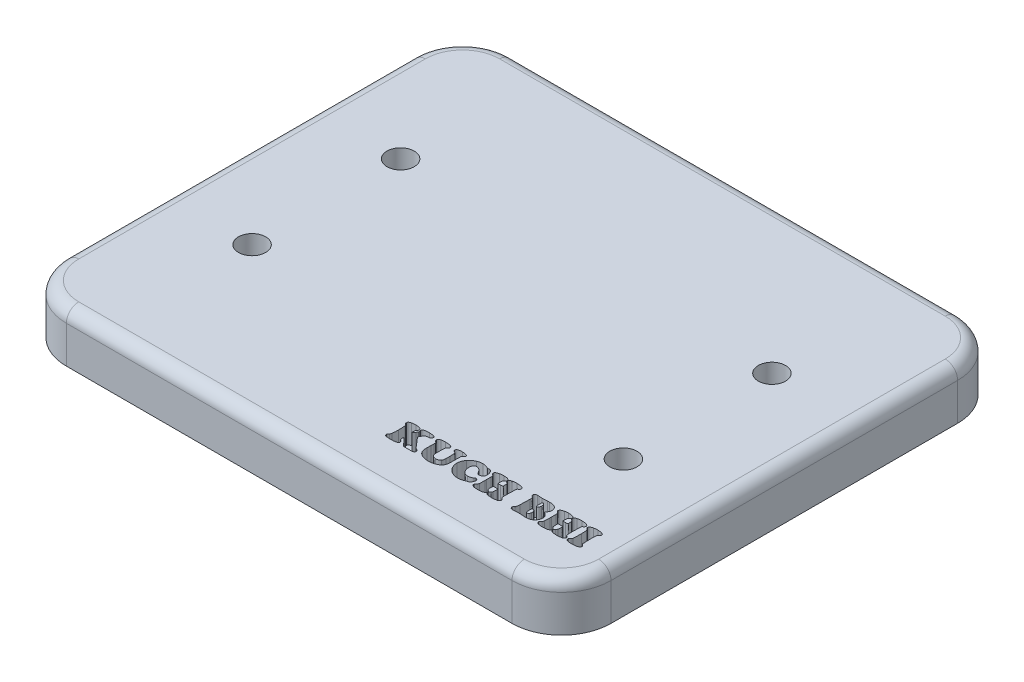
from build123d import *

# Parameters (mm, degrees)
BOSS_EXTRUDE1_DEPTH = 20
FILLET1_R           = 5
SKETCH2_R           = 5.5
CUT_EXTRUDE1_DEPTH  = 144.527001021
SKETCH3_R           = 9
CUT_EXTRUDE2_DEPTH  = 11
CUT_EXTRUDE3_DEPTH  = 8


with BuildPart() as part:
    # Sketch1 → Boss-Extrude1 (new body)
    with BuildSketch(Plane(origin=(0, 0, 0), x_dir=(1, 0, 0), z_dir=(0, 1, 0))):
        with BuildLine():
            Line((-90, 90), (90, 90))
            ThreePointArc((90, 90), (104.142135624, 84.142135624), (110, 70))
            Line((110, 70), (110, -70))
            ThreePointArc((110, -70), (104.142135624, -84.142135624), (90, -90))
            Line((90, -90), (-90, -90))
            ThreePointArc((-90, -90), (-104.142135624, -84.142135624), (-110, -70))
            Line((-110, -70), (-110, 70))
            ThreePointArc((-110, 70), (-104.142135624, 84.142135624), (-90, 90))
        make_face()
    extrude(amount=BOSS_EXTRUDE1_DEPTH)

    # Fillet1
    fillet1_edges = [part.edges().sort_by_distance(p)[0] for p in [
        (-104.142135624, 20, -84.142135624),
        (-110, 20, 0),
        (-104.142135624, 20, 84.142135624),
        (0, 20, 90),
        (104.142135624, 20, 84.142135624),
        (110, 20, 0),
        (104.142135624, 20, -84.142135624),
        (0, 20, -90),
    ]]
    fillet(fillet1_edges, radius=FILLET1_R)

    # Sketch2 → Cut-Extrude1 (cut, through all)
    with BuildSketch(Plane(origin=(0, 20, 0), x_dir=(1, 0, 0), z_dir=(0, 1, 0))):
        with Locations(Location((-75, 30, 0), (0, 0, 270))):
            Circle(SKETCH2_R)
        with Locations(Location((75, 30, 0), (0, 0, 270))):
            Circle(SKETCH2_R)
    cut_extrude1 = extrude(amount=-CUT_EXTRUDE1_DEPTH, mode=Mode.SUBTRACT)

    # Sketch3 → Cut-Extrude2 (cut)
    with BuildSketch(Plane.XZ):
        with Locations(Location((-75, -30, 0), (0, 0, 270))):
            Circle(SKETCH3_R)
        with Locations(Location((75, -30, 0), (0, 0, 270))):
            Circle(SKETCH3_R)
    cut_extrude2 = extrude(amount=-CUT_EXTRUDE2_DEPTH, mode=Mode.SUBTRACT)

    # Mirror1: Cut-Extrude1, Cut-Extrude2 across plane
    add(cut_extrude1.mirror(Plane.XY), mode=Mode.SUBTRACT)
    add(cut_extrude2.mirror(Plane.XY), mode=Mode.SUBTRACT)

    # Sketch4 → Cut-Extrude3 (cut)
    # profile 1 of 7: a face of its own
    with BuildSketch(Plane(origin=(0, 20, 0), x_dir=(1, 0, 0), z_dir=(0, 1, 0))):
        with BuildLine():
            Line((26.802918754, -62.21455254), (26.078678889, -62.978910649))
            add(Edge.make_bspline(
                [(26.078678889, -62.978910649), (26.032432407, -63.032420513), (25.944650897, -63.133988815), (25.848322621, -63.301129207), (25.786462489, -63.46803987), (25.778487402, -63.580914481), (25.774624835, -63.635582946)],
                knots=[0, 0, 0, 0, 1.144639861, 2.172667224, 3.114969454, 4, 4, 4, 4], degree=3))
            add(Edge.make_bspline(
                [(25.774624835, -63.635582946), (25.778360905, -63.697463336), (25.78583694, -63.821288634), (25.845994851, -63.96937359), (25.913701605, -64.086979352), (25.98224502, -64.185415593), (26.063946421, -64.295134856), (26.126132579, -64.369292941), (26.158915375, -64.408387)],
                knots=[0, 0, 0, 0, 1.257204683, 2.51572015, 3.210175855, 4.026456452, 4.959603267, 6, 6, 6, 6], degree=3))
            Line((26.158915375, -64.408387), (28.83628024, -67.512272135))
            add(Edge.make_bspline(
                [(28.83628024, -67.512272135), (28.894660335, -67.581973805), (28.998869259, -67.706391831), (29.137450808, -67.870991652), (29.245240073, -67.987187677), (29.343960843, -68.086864306), (29.466092822, -68.172316282), (29.567534764, -68.22378404), (29.621753213, -68.251292405)],
                knots=[0, 0, 0, 0, 1.502282813, 2.68158656, 3.553801245, 4.121219401, 4.995833793, 6, 6, 6, 6], degree=3))
            add(Edge.make_bspline(
                [(29.621753213, -68.251292405), (29.696996203, -68.281555517), (29.837425279, -68.338036804), (30.024890834, -68.437825287), (30.177191952, -68.53960754), (30.293729641, -68.649879465), (30.37748405, -68.767978085), (30.442953493, -68.892397268), (30.474797505, -69.031712484), (30.480393858, -69.127442913), (30.4832397, -69.176123486)],
                knots=[0, 0, 0, 0, 1.434081198, 2.676484527, 3.750796552, 4.666772852, 5.496299456, 6.303847937, 7.137477439, 8, 8, 8, 8], degree=3))
            add(Edge.make_bspline(
                [(30.4832397, -69.176123486), (30.479639769, -69.240772223), (30.472716872, -69.365095852), (30.406603397, -69.537697809), (30.29795319, -69.68377037), (30.145582184, -69.800620422), (29.950996133, -69.888664538), (29.717458293, -69.952704915), (29.442000604, -69.989222466), (29.245318249, -69.993237253), (29.140334294, -69.995380243)],
                knots=[0, 0, 0, 0, 0.872565956, 1.677999775, 2.461478673, 3.309975026, 4.247969235, 5.337246801, 6.578691208, 8, 8, 8, 8], degree=3))
            Line((29.140334294, -69.995380243), (26.450300511, -69.995380243))
            add(Edge.make_bspline(
                [(26.450300511, -69.995380243), (26.398829984, -69.993904365), (26.301517021, -69.99111399), (26.163496477, -69.966537508), (26.044237757, -69.921364481), (25.93323121, -69.858677479), (25.826945613, -69.756862565), (25.704273732, -69.619102469), (25.556059463, -69.438874641), (25.453082142, -69.301859348), (25.396668754, -69.226799162)],
                knots=[0, 0, 0, 0, 0.900711183, 1.702933295, 2.439769861, 3.124391065, 3.918340174, 4.999839374, 6.356441751, 8, 8, 8, 8], degree=3))
            add(Edge.make_bspline(
                [(25.396668754, -69.226799162), (25.29850077, -69.095746949), (25.092691017, -68.820995219), (24.747072334, -68.406736745), (24.364700908, -67.960138278), (24.087854957, -67.659882304), (23.943966051, -67.503826189)],
                knots=[0, 0, 0, 0, 0.871293462, 1.826671836, 2.870426642, 4, 4, 4, 4], degree=3))
            add(Edge.make_bspline(
                [(23.943966051, -67.503826189), (23.884889796, -67.441842781), (23.777736309, -67.329416251), (23.632889352, -67.178691187), (23.516857557, -67.065667567), (23.42691133, -66.986802288), (23.357217412, -66.929739379), (23.295744629, -66.8956343), (23.243100896, -66.867852678), (23.208011294, -66.865224347), (23.192276862, -66.864045784)],
                knots=[0, 0, 0, 0, 2.053515339, 3.724700007, 5.013989091, 5.934982476, 6.596747831, 7.164170021, 7.625207792, 8, 8, 8, 8], degree=3))
            add(Edge.make_bspline(
                [(23.192276862, -66.864045784), (23.180328031, -66.866380824), (23.154761033, -66.871377125), (23.126976406, -66.908013866), (23.101072634, -66.956972808), (23.085211318, -67.028450611), (23.066911832, -67.116622719), (23.05823027, -67.225709656), (23.05170908, -67.353813156), (23.051121226, -67.446094822), (23.050807267, -67.495380243)],
                knots=[0, 0, 0, 0, 0.417645888, 0.893639891, 1.539982195, 2.392194852, 3.457424255, 4.734164094, 6.255795507, 8, 8, 8, 8], degree=3))
            add(Edge.make_bspline(
                [(23.050807267, -67.495380243), (23.051010993, -67.543953376), (23.051395191, -67.635555679), (23.059552154, -67.766047843), (23.07497646, -67.882148093), (23.091974338, -67.98506301), (23.118386727, -68.073050329), (23.146728076, -68.147488116), (23.181900036, -68.208977155), (23.213386545, -68.239207963), (23.228172132, -68.253403892)],
                knots=[0, 0, 0, 0, 1.46211688, 2.757352993, 3.932086421, 4.987659448, 5.892805851, 6.691507231, 7.385551634, 8, 8, 8, 8], degree=3))
            add(Edge.make_bspline(
                [(23.228172132, -68.253403892), (23.237958627, -68.260540779), (23.263364618, -68.279068319), (23.312563679, -68.309463525), (23.376493422, -68.35469432), (23.4264658, -68.386004492), (23.454101186, -68.403319432)],
                knots=[0, 0, 0, 0, 0.535837127, 1.391046829, 2.55721438, 4, 4, 4, 4], degree=3))
            add(Edge.make_bspline(
                [(23.454101186, -68.403319432), (23.496837589, -68.430034096), (23.578753296, -68.481239869), (23.688961695, -68.566862952), (23.784760959, -68.651979884), (23.862461387, -68.741962117), (23.922114389, -68.835232964), (23.965025648, -68.931210098), (23.991865374, -69.029685509), (23.995128177, -69.096429169), (23.996753213, -69.129670784)],
                knots=[0, 0, 0, 0, 1.273705656, 2.441396354, 3.524934978, 4.509518135, 5.437792039, 6.31428324, 7.160430415, 8, 8, 8, 8], degree=3))
            add(Edge.make_bspline(
                [(23.996753213, -69.129670784), (23.995025806, -69.172843291), (23.991654638, -69.257097773), (23.956115159, -69.378612288), (23.897634926, -69.489584316), (23.818640639, -69.592875274), (23.714332105, -69.683975281), (23.589228114, -69.766133806), (23.441172669, -69.837657252), (23.271381043, -69.900668494), (23.077585799, -69.954686208), (22.85993418, -70.003358246), (22.617336293, -70.042641618), (22.350230359, -70.073609998), (22.058700722, -70.098587052), (21.741908764, -70.117878165), (21.400390085, -70.127648161), (21.164551028, -70.129539071), (21.042783619, -70.130515378)],
                knots=[0, 0, 0, 0, 0.610641544, 1.191714125, 1.776287946, 2.380950292, 3.023909509, 3.729535071, 4.496990646, 5.349430785, 6.293673728, 7.346619652, 8.509535439, 9.775521389, 11.157550897, 12.656800858, 14.273853771, 16, 16, 16, 16], degree=3))
            add(Edge.make_bspline(
                [(21.042783619, -70.130515378), (20.937201372, -70.130343812), (20.733037672, -70.130012054), (20.438105533, -70.120903707), (20.164947642, -70.108685898), (19.913647791, -70.091639332), (19.68385121, -70.071953713), (19.476319399, -70.043543981), (19.289782314, -70.013834692), (19.1739718, -69.98553384), (19.11921943, -69.972153892)],
                knots=[0, 0, 0, 0, 1.309924044, 2.532991556, 3.66071905, 4.702247989, 5.658102377, 6.521397233, 7.300952872, 8, 8, 8, 8], degree=3))
            add(Edge.make_bspline(
                [(19.11921943, -69.972153892), (19.072255872, -69.956549044), (18.980722714, -69.926134803), (18.852930261, -69.858919961), (18.739607843, -69.77435285), (18.638872184, -69.675383673), (18.55946018, -69.561006231), (18.498685231, -69.438420698), (18.464039328, -69.3053553), (18.458864353, -69.214322939), (18.456212673, -69.16767754)],
                knots=[0, 0, 0, 0, 1.059415345, 2.064827201, 3.078579125, 4.081271196, 5.077359796, 6.048929802, 7.000262712, 8, 8, 8, 8], degree=3))
            add(Edge.make_bspline(
                [(18.456212673, -69.16767754), (18.461894064, -69.095641334), (18.473238512, -68.951801404), (18.566999902, -68.748995556), (18.716018077, -68.565669722), (18.848342298, -68.470671171), (18.918628213, -68.420211324)],
                knots=[0, 0, 0, 0, 0.939520066, 1.876008027, 2.871811094, 4, 4, 4, 4], degree=3))
            add(Edge.make_bspline(
                [(18.918628213, -68.420211324), (18.96530695, -68.385324416), (19.052257287, -68.320339186), (19.130961266, -68.207050211), (19.176963882, -68.102752893), (19.206419258, -67.998605679), (19.238531893, -67.869130369), (19.256962756, -67.77350672), (19.267023484, -67.721309297)],
                knots=[0, 0, 0, 0, 1.292040983, 2.406736084, 3.024996391, 3.829212685, 4.815047265, 6, 6, 6, 6], degree=3))
            add(Edge.make_bspline(
                [(19.267023484, -67.721309297), (19.278091853, -67.650996772), (19.301610686, -67.501591871), (19.327902256, -67.26342324), (19.35106777, -66.999420835), (19.369746896, -66.71006022), (19.384401407, -66.394693827), (19.394660661, -66.053291092), (19.401053509, -65.685860927), (19.401782169, -65.43246073), (19.402158619, -65.301545784)],
                knots=[0, 0, 0, 0, 0.70410058, 1.496121435, 2.369873404, 3.325875229, 4.364522422, 5.493082839, 6.704843455, 8, 8, 8, 8], degree=3))
            add(Edge.make_bspline(
                [(19.402158619, -65.301545784), (19.401785533, -65.145997254), (19.401066338, -64.846147654), (19.394704541, -64.413265172), (19.384458676, -64.014857003), (19.36990897, -63.651630363), (19.351337224, -63.324256973), (19.328166915, -63.032099239), (19.30193221, -62.774215721), (19.278119564, -62.614257754), (19.267023484, -62.539721459)],
                knots=[0, 0, 0, 0, 1.348933748, 2.600328302, 3.75433313, 4.805040337, 5.752708906, 6.597692569, 7.346560842, 8, 8, 8, 8], degree=3))
            add(Edge.make_bspline(
                [(19.267023484, -62.539721459), (19.258808096, -62.491845042), (19.24352088, -62.402756469), (19.219266176, -62.280782342), (19.183985954, -62.183987177), (19.136096358, -62.079560722), (19.034373266, -61.966227342), (18.933200621, -61.898082112), (18.876398484, -61.859822811)],
                knots=[0, 0, 0, 0, 1.067002038, 1.985480432, 2.723486221, 3.324743107, 4.498009907, 6, 6, 6, 6], degree=3))
            add(Edge.make_bspline(
                [(18.876398484, -61.859822811), (18.812325242, -61.814337283), (18.689392551, -61.727067494), (18.554246512, -61.548085917), (18.468281658, -61.343486592), (18.460303242, -61.196277362), (18.456212673, -61.12080254)],
                knots=[0, 0, 0, 0, 1.054734211, 2.023642201, 2.986712639, 4, 4, 4, 4], degree=3))
            add(Edge.make_bspline(
                [(18.456212673, -61.12080254), (18.459133355, -61.057078359), (18.464753864, -60.934448657), (18.517047093, -60.761131094), (18.603195101, -60.609058832), (18.726544382, -60.479053834), (18.884358272, -60.369721079), (19.075135451, -60.274916283), (19.300441813, -60.194432285), (19.464986636, -60.158159288), (19.552074159, -60.138961324)],
                knots=[0, 0, 0, 0, 0.944713437, 1.817990051, 2.660946763, 3.519069943, 4.456173266, 5.498905555, 6.676262693, 8, 8, 8, 8], degree=3))
            add(Edge.make_bspline(
                [(19.552074159, -60.138961324), (19.675702043, -60.116158216), (19.93651421, -60.068051527), (20.353036156, -60.027730901), (20.811511902, -59.9988891), (21.131409893, -59.996583092), (21.298273484, -59.995380243)],
                knots=[0, 0, 0, 0, 0.859311067, 1.812849773, 2.859149627, 4, 4, 4, 4], degree=3))
            add(Edge.make_bspline(
                [(21.298273484, -59.995380243), (21.389782045, -59.996282673), (21.565823338, -59.998018739), (21.820720321, -60.008661739), (22.057322801, -60.025448288), (22.275886975, -60.047544253), (22.476241197, -60.07880745), (22.656759043, -60.119995802), (22.820975375, -60.161682098), (22.920908671, -60.20065404), (22.968459294, -60.219197811)],
                knots=[0, 0, 0, 0, 1.296086799, 2.493371012, 3.612712099, 4.655241835, 5.604157051, 6.482140322, 7.277766495, 8, 8, 8, 8], degree=3))
            add(Edge.make_bspline(
                [(22.968459294, -60.219197811), (23.017612085, -60.242031248), (23.112147011, -60.285946502), (23.239450437, -60.367079156), (23.349664424, -60.454989849), (23.43649239, -60.556671401), (23.50798166, -60.664153085), (23.557202253, -60.782368038), (23.584692886, -60.90980536), (23.589085091, -60.997500136), (23.591347808, -61.04267754)],
                knots=[0, 0, 0, 0, 1.180346569, 2.270145296, 3.283942015, 4.240989658, 5.173109903, 6.087891605, 7.014945942, 8, 8, 8, 8], degree=3))
            add(Edge.make_bspline(
                [(23.591347808, -61.04267754), (23.588500736, -61.107181573), (23.583259537, -61.225927609), (23.531630115, -61.370696308), (23.454116145, -61.475494857), (23.365614125, -61.575435659), (23.242921134, -61.696678665), (23.14762134, -61.782827653), (23.095148484, -61.830262)],
                knots=[0, 0, 0, 0, 1.196767847, 2.20314037, 2.794976518, 3.611238618, 4.684728172, 6, 6, 6, 6], degree=3))
            add(Edge.make_bspline(
                [(23.095148484, -61.830262), (23.090737087, -61.840047196), (23.075783275, -61.873217183), (23.058225895, -61.946964456), (23.030562687, -62.062508489), (22.978313973, -62.270776294), (22.928771154, -62.565095753), (22.920046874, -62.808361971), (22.915672132, -62.930346459)],
                knots=[0, 0, 0, 0, 0.172470392, 0.584642403, 1.213566365, 2.086924847, 4.037810295, 6, 6, 6, 6], degree=3))
            add(Edge.make_bspline(
                [(22.915672132, -62.930346459), (22.916208335, -62.996565103), (22.917126767, -63.109987398), (22.912356748, -63.251677896), (22.914798499, -63.338018361), (22.905326614, -63.375196472), (22.903003213, -63.384316054)],
                knots=[0, 0, 0, 0, 1.745606799, 2.989954477, 3.752241495, 4, 4, 4, 4], degree=3))
            add(Edge.make_bspline(
                [(22.903003213, -63.384316054), (22.940149636, -63.377230604), (23.025902428, -63.360873792), (23.104599628, -63.288324965), (23.167205561, -63.226281929), (23.213424787, -63.175182107), (23.26961642, -63.109770912), (23.338053723, -63.032243509), (23.413478097, -62.937670941), (23.50202542, -62.831734762), (23.599430147, -62.71031857), (23.667393088, -62.624909427), (23.703256592, -62.579839703)],
                knots=[0, 0, 0, 0, 0.967350676, 2.2331362, 2.672881924, 3.268394091, 4.020330404, 4.915095544, 5.954951975, 7.163405159, 8.503151468, 10, 10, 10, 10], degree=3))
            add(Edge.make_bspline(
                [(23.703256592, -62.579839703), (23.743080408, -62.529473211), (23.818534429, -62.434044025), (23.919114616, -62.294228312), (24.006705316, -62.169579038), (24.078356344, -62.058615636), (24.134286563, -61.961685502), (24.172860221, -61.878333285), (24.198775626, -61.808510562), (24.203648092, -61.764953386), (24.205790375, -61.74580254)],
                knots=[0, 0, 0, 0, 1.567551932, 2.970034233, 4.204756485, 5.286892547, 6.194959732, 6.933133249, 7.530929187, 8, 8, 8, 8], degree=3))
            add(Edge.make_bspline(
                [(24.205790375, -61.74580254), (24.204342422, -61.727377036), (24.200986812, -61.684676209), (24.176661431, -61.614242912), (24.140447712, -61.528077267), (24.110394561, -61.465548202), (24.093881592, -61.431191054)],
                knots=[0, 0, 0, 0, 0.657730594, 1.52428071, 2.639694144, 4, 4, 4, 4], degree=3))
            add(Edge.make_bspline(
                [(24.093881592, -61.431191054), (24.066135037, -61.36739833), (24.013824024, -61.247128911), (24.002207947, -61.116627802), (23.996753213, -61.055346459)],
                knots=[0, 0, 0, 0, 1.060830323, 2, 2, 2, 2], degree=3))
            add(Edge.make_bspline(
                [(23.996753213, -61.055346459), (23.999073933, -61.007381833), (24.00358412, -60.914165336), (24.030064351, -60.77943961), (24.080024385, -60.656989677), (24.14859281, -60.545804705), (24.23605275, -60.444710564), (24.345269379, -60.358921881), (24.472373722, -60.283727322), (24.619856232, -60.221339827), (24.787977478, -60.166487373), (24.979320526, -60.120177851), (25.194861073, -60.084288537), (25.433259029, -60.049329397), (25.695424703, -60.024798009), (25.981384733, -60.008699471), (26.291156563, -59.998023964), (26.505893744, -59.996282278), (26.617107943, -59.995380243)],
                knots=[0, 0, 0, 0, 0.734580586, 1.427615184, 2.089817431, 2.74762312, 3.419569276, 4.124559353, 4.863629457, 5.674228806, 6.570250574, 7.568420608, 8.684304621, 9.91386126, 11.256025093, 12.713008658, 14.297639432, 16, 16, 16, 16], degree=3))
            add(Edge.make_bspline(
                [(26.617107943, -59.995380243), (26.707905459, -59.995763035), (26.883893251, -59.996504979), (27.138730419, -60.002820103), (27.375267448, -60.013238725), (27.59287575, -60.027451099), (27.791949345, -60.047391956), (27.973313005, -60.06675051), (28.136090892, -60.094022852), (28.237418282, -60.117389335), (28.285182267, -60.128403892)],
                knots=[0, 0, 0, 0, 1.299584259, 2.518912117, 3.648323204, 4.688338057, 5.639623973, 6.511824757, 7.298499838, 8, 8, 8, 8], degree=3))
            add(Edge.make_bspline(
                [(28.285182267, -60.128403892), (28.351834642, -60.146606952), (28.478183994, -60.181113523), (28.651145957, -60.253593164), (28.798939756, -60.337688083), (28.920647954, -60.434847044), (29.017120507, -60.544084246), (29.083335519, -60.667784226), (29.125810697, -60.803433843), (29.129828182, -60.898771492), (29.131888348, -60.947660649)],
                knots=[0, 0, 0, 0, 1.294304717, 2.453544422, 3.506019197, 4.472590419, 5.36145047, 6.217679692, 7.086025967, 8, 8, 8, 8], degree=3))
            add(Edge.make_bspline(
                [(29.131888348, -60.947660649), (29.129957152, -60.984520331), (29.126014686, -61.059768031), (29.089246116, -61.171002815), (29.032837175, -61.281974614), (28.958070231, -61.392810102), (28.862365291, -61.496595241), (28.742222434, -61.581583486), (28.604240247, -61.653195556), (28.501248773, -61.682184694), (28.447766727, -61.697238351)],
                knots=[0, 0, 0, 0, 0.810370042, 1.654340927, 2.55620266, 3.550092361, 4.592665796, 5.647629403, 6.778446548, 8, 8, 8, 8], degree=3))
            add(Edge.make_bspline(
                [(28.447766727, -61.697238351), (28.411969875, -61.704896019), (28.322166095, -61.724106855), (28.155899476, -61.737741026), (27.93269354, -61.747484517), (27.764372366, -61.750474018), (27.6707397, -61.752137)],
                knots=[0, 0, 0, 0, 0.562561762, 1.411302107, 2.559975064, 4, 4, 4, 4], degree=3))
            add(Edge.make_bspline(
                [(27.6707397, -61.752137), (27.625649064, -61.75350441), (27.541538927, -61.756055119), (27.424806948, -61.770456231), (27.32672069, -61.792749447), (27.239976274, -61.82646467), (27.155851346, -61.884559888), (27.056401959, -61.966426235), (26.934473268, -62.077869973), (26.849519164, -62.166135626), (26.802918754, -62.21455254)],
                knots=[0, 0, 0, 0, 1.056157488, 1.970110847, 2.74977056, 3.407907489, 4.134903294, 5.131218911, 6.426369419, 8, 8, 8, 8], degree=3))
        make_face()
    # profile 2 of 7: a face of its own
    with BuildSketch(Plane(origin=(0, 20, 0), x_dir=(1, 0, 0), z_dir=(0, 1, 0))):
        with BuildLine():
            Line((41.291939024, -63.766495108), (41.294050511, -65.468353216))
            add(Edge.make_bspline(
                [(41.294050511, -65.468353216), (41.292990328, -65.592225916), (41.290941852, -65.831571628), (41.282340945, -66.178141688), (41.259072894, -66.497516771), (41.236586215, -66.790931845), (41.199398759, -67.056921825), (41.158484635, -67.297479186), (41.10948739, -67.511800271), (41.065570242, -67.642763208), (41.044895105, -67.704417405)],
                knots=[0, 0, 0, 0, 1.315998442, 2.542760293, 3.681687839, 4.717377219, 5.667987535, 6.533358337, 7.309540413, 8, 8, 8, 8], degree=3))
            add(Edge.make_bspline(
                [(41.044895105, -67.704417405), (40.998747645, -67.817164389), (40.906572638, -68.042365385), (40.711353879, -68.353970195), (40.480525054, -68.645836489), (40.205060555, -68.913851567), (39.885671921, -69.155972486), (39.52672446, -69.377399682), (39.127870049, -69.580625066), (38.840961469, -69.689805152), (38.692699159, -69.746224838)],
                knots=[0, 0, 0, 0, 0.906892554, 1.811428571, 2.73017801, 3.676495972, 4.668396145, 5.712521538, 6.817927157, 8, 8, 8, 8], degree=3))
            add(Edge.make_bspline(
                [(38.692699159, -69.746224838), (38.604346354, -69.777512573), (38.425656703, -69.840790637), (38.148919436, -69.917607724), (37.862972467, -69.983692101), (37.566778469, -70.035743293), (37.260383286, -70.077691161), (36.943598699, -70.110487399), (36.616566643, -70.126202284), (36.395414213, -70.12906607), (36.283493078, -70.130515378)],
                knots=[0, 0, 0, 0, 0.917111739, 1.854818053, 2.80897837, 3.788633903, 4.796933389, 5.835372595, 6.90452229, 8, 8, 8, 8], degree=3))
            add(Edge.make_bspline(
                [(36.283493078, -70.130515378), (36.096163586, -70.127368701), (35.729940815, -70.121217053), (35.194887974, -70.070443312), (34.688805077, -69.984275385), (34.211352868, -69.864020673), (33.761720874, -69.710052815), (33.340535967, -69.521632655), (32.945513874, -69.301546324), (32.706931901, -69.12324396), (32.588391727, -69.034653892)],
                knots=[0, 0, 0, 0, 1.14469758, 2.237844752, 3.280903698, 4.279298737, 5.243749819, 6.181441706, 7.096443816, 8, 8, 8, 8], degree=3))
            add(Edge.make_bspline(
                [(32.588391727, -69.034653892), (32.479330827, -68.942520064), (32.267189436, -68.763304613), (32.001853638, -68.451844212), (31.784766732, -68.123530717), (31.650053865, -67.826801271), (31.569046743, -67.573243335), (31.517449549, -67.363416787), (31.469724424, -67.135581061), (31.436112365, -66.88772439), (31.404863166, -66.621824729), (31.388051476, -66.33562364), (31.374208824, -66.030847608), (31.372865133, -65.820990639), (31.372175511, -65.713285649)],
                knots=[0, 0, 0, 0, 1.392436625, 2.708518293, 3.980333235, 5.22632031, 5.876358537, 6.578306165, 7.33600783, 8.148779146, 9.020306078, 9.95043378, 10.948100175, 12, 12, 12, 12], degree=3))
            add(Edge.make_bspline(
                [(31.372175511, -65.713285649), (31.372010023, -65.666831774), (31.371656466, -65.567584713), (31.374721967, -65.408532275), (31.376004713, -65.229738695), (31.380514929, -65.030549402), (31.387349306, -64.810988391), (31.39363825, -64.570276302), (31.399345599, -64.309120586), (31.405095119, -64.128258818), (31.408070781, -64.034653892)],
                knots=[0, 0, 0, 0, 0.663973072, 1.418554993, 2.273731004, 3.219603645, 4.26629945, 5.413559074, 6.661388669, 8, 8, 8, 8], degree=3))
            add(Edge.make_bspline(
                [(31.408070781, -64.034653892), (31.409456356, -63.969197293), (31.412123267, -63.843208565), (31.416272244, -63.663730475), (31.420445261, -63.501142465), (31.425013439, -63.356888172), (31.427827789, -63.228781577), (31.426019392, -63.118952729), (31.429770935, -63.026082059), (31.429368848, -62.970466798), (31.429185646, -62.945126865)],
                knots=[0, 0, 0, 0, 1.441858512, 2.775242249, 3.953670684, 5.023638578, 5.953784004, 6.775298372, 7.441990241, 8, 8, 8, 8], degree=3))
            add(Edge.make_bspline(
                [(31.429185646, -62.945126865), (31.428763449, -62.861346899), (31.427989186, -62.707703486), (31.413452945, -62.499639897), (31.392527844, -62.335427625), (31.359772741, -62.206781761), (31.302316187, -62.104547766), (31.231283578, -62.007079372), (31.128131284, -61.92035291), (31.0515992, -61.865575455), (31.011111321, -61.836596459)],
                knots=[0, 0, 0, 0, 1.598825354, 2.932073083, 3.976962726, 4.759347985, 5.444462097, 6.202122467, 7.048866256, 8, 8, 8, 8], degree=3))
            add(Edge.make_bspline(
                [(31.011111321, -61.836596459), (30.968855463, -61.808706511), (30.887813815, -61.75521695), (30.782239939, -61.662409922), (30.690273171, -61.570466271), (30.615531658, -61.473867561), (30.554395155, -61.375066631), (30.515516058, -61.26994849), (30.487756904, -61.163054463), (30.48475253, -61.090013958), (30.4832397, -61.053234973)],
                knots=[0, 0, 0, 0, 1.230358883, 2.359680167, 3.413231621, 4.389489361, 5.326352533, 6.226336239, 7.106885251, 8, 8, 8, 8], degree=3))
            add(Edge.make_bspline(
                [(30.4832397, -61.053234973), (30.486591769, -61.000072711), (30.493260663, -60.894307138), (30.543907316, -60.742161657), (30.626393473, -60.601032611), (30.742134938, -60.476008847), (30.880531092, -60.364197146), (31.041121844, -60.274024342), (31.218189603, -60.200465037), (31.344896773, -60.169629598), (31.410182267, -60.15374173)],
                knots=[0, 0, 0, 0, 0.91120899, 1.812837481, 2.722443357, 3.697636338, 4.720241843, 5.764665201, 6.848250372, 8, 8, 8, 8], degree=3))
            add(Edge.make_bspline(
                [(31.410182267, -60.15374173), (31.541527151, -60.128746077), (31.814183747, -60.076858029), (32.244085968, -60.031690589), (32.706188347, -60.001256392), (33.0254125, -59.99738057), (33.190165375, -59.995380243)],
                knots=[0, 0, 0, 0, 0.896033859, 1.860061356, 2.895569016, 4, 4, 4, 4], degree=3))
            add(Edge.make_bspline(
                [(33.190165375, -59.995380243), (33.373932634, -59.996993707), (33.724918168, -60.000075335), (34.226680346, -60.034367546), (34.678594432, -60.087706975), (34.95991554, -60.146923949), (35.0926147, -60.174856594)],
                knots=[0, 0, 0, 0, 1.151421672, 2.199153167, 3.15054059, 4, 4, 4, 4], degree=3))
            add(Edge.make_bspline(
                [(35.0926147, -60.174856594), (35.165579866, -60.193705186), (35.304642426, -60.229628264), (35.495921273, -60.305249023), (35.657972838, -60.396108606), (35.793225185, -60.499860336), (35.896178484, -60.622067048), (35.969596498, -60.758681163), (36.016143066, -60.909495948), (36.021187167, -61.015587352), (36.02378024, -61.070126865)],
                knots=[0, 0, 0, 0, 1.283815814, 2.446793767, 3.494452655, 4.442578967, 5.336633099, 6.195541623, 7.072363277, 8, 8, 8, 8], degree=3))
            add(Edge.make_bspline(
                [(36.02378024, -61.070126865), (36.020805292, -61.122018312), (36.014857325, -61.225767518), (35.957061123, -61.375030951), (35.869355428, -61.517330011), (35.789096351, -61.599447945), (35.747175511, -61.642339703)],
                knots=[0, 0, 0, 0, 0.949156634, 1.897697074, 2.901927245, 4, 4, 4, 4], degree=3))
            add(Edge.make_bspline(
                [(35.747175511, -61.642339703), (35.736690906, -61.649495885), (35.700164705, -61.674426546), (35.616329393, -61.718589252), (35.483311965, -61.790927828), (35.377695629, -61.847894076), (35.316432267, -61.880937676)],
                knots=[0, 0, 0, 0, 0.309120746, 1.076912883, 2.304446536, 4, 4, 4, 4], degree=3))
            add(Edge.make_bspline(
                [(35.316432267, -61.880937676), (35.304420111, -61.889403765), (35.2754202, -61.909842714), (35.246819004, -61.968221535), (35.215768584, -62.045549636), (35.182493564, -62.151038383), (35.155443764, -62.292290974), (35.138292351, -62.477419363), (35.1289079, -62.709240582), (35.127283921, -62.879659288), (35.126398484, -62.972576189)],
                knots=[0, 0, 0, 0, 0.307772173, 0.743027754, 1.339072747, 2.089846878, 3.079458784, 4.385225527, 6.029126904, 8, 8, 8, 8], degree=3))
            add(Edge.make_bspline(
                [(35.126398484, -62.972576189), (35.126640935, -63.02114303), (35.127213757, -63.135888368), (35.121201923, -63.333625415), (35.117516412, -63.584195686), (35.114408914, -63.887593231), (35.104172, -64.244371404), (35.096910354, -64.654039777), (35.085938893, -65.116447782), (35.077865871, -65.442312431), (35.073611321, -65.614045784)],
                knots=[0, 0, 0, 0, 0.44115126, 1.042275949, 1.796816895, 2.717569188, 3.798372708, 5.038974654, 6.439515269, 8, 8, 8, 8], degree=3))
            add(Edge.make_bspline(
                [(35.073611321, -65.614045784), (35.072654947, -65.70911826), (35.070802586, -65.893260108), (35.095275252, -66.160081452), (35.135537886, -66.407963522), (35.199849416, -66.636410367), (35.282458751, -66.845972645), (35.390753724, -67.034340029), (35.515932406, -67.205063984), (35.61689364, -67.301757669), (35.666939024, -67.349687676)],
                knots=[0, 0, 0, 0, 1.203262213, 2.330547575, 3.388472087, 4.378917376, 5.330586695, 6.23267568, 7.123956571, 8, 8, 8, 8], degree=3))
            add(Edge.make_bspline(
                [(35.666939024, -67.349687676), (35.712538395, -67.388824105), (35.802927318, -67.466401921), (35.9533615, -67.562642063), (36.108395888, -67.648123363), (36.27240046, -67.715314774), (36.443197062, -67.76897089), (36.622018867, -67.806887039), (36.808779032, -67.827382188), (36.935192921, -67.831254666), (36.999286997, -67.833218081)],
                knots=[0, 0, 0, 0, 0.993175809, 1.968713353, 2.948413358, 3.919561117, 4.895724161, 5.907638874, 6.939135925, 8, 8, 8, 8], degree=3))
            add(Edge.make_bspline(
                [(36.999286997, -67.833218081), (37.090920282, -67.83081669), (37.269286407, -67.826142333), (37.529410044, -67.788806468), (37.775002994, -67.731434507), (38.003373733, -67.646255068), (38.210761934, -67.541872131), (38.395399482, -67.42147487), (38.552616762, -67.281827244), (38.635190621, -67.173044158), (38.675807267, -67.119535649)],
                knots=[0, 0, 0, 0, 1.162490976, 2.262813231, 3.328768946, 4.357546368, 5.348274231, 6.269905075, 7.148996372, 8, 8, 8, 8], degree=3))
            add(Edge.make_bspline(
                [(38.675807267, -67.119535649), (38.70502445, -67.077243375), (38.76343959, -66.992686655), (38.832581482, -66.852984306), (38.890259176, -66.706468417), (38.930788676, -66.545970726), (38.959423785, -66.366413193), (38.983098141, -66.160068316), (38.994440091, -65.923152449), (38.995952839, -65.755523239), (38.996753213, -65.666832946)],
                knots=[0, 0, 0, 0, 0.813592064, 1.626648795, 2.463456555, 3.304786231, 4.243601192, 5.34350544, 6.594485522, 8, 8, 8, 8], degree=3))
            Line((38.996753213, -65.666832946), (38.996753213, -64.127559297))
            add(Edge.make_bspline(
                [(38.996753213, -64.127559297), (38.994251716, -63.988897281), (38.989527629, -63.727033474), (38.978121177, -63.357559401), (38.968668489, -63.034432168), (38.955684424, -62.75784113), (38.942880584, -62.527713374), (38.931966541, -62.344440827), (38.916696936, -62.207954607), (38.900283132, -62.087947738), (38.85835667, -61.972173205), (38.774929465, -61.856342604), (38.654013419, -61.761075126), (38.559232504, -61.712451053), (38.508999835, -61.686680919)],
                knots=[0, 0, 0, 0, 1.905360052, 3.598280547, 5.078562813, 6.34664578, 7.402258933, 8.245537248, 8.868100656, 9.289379284, 9.907344727, 10.537966578, 11.225141042, 12, 12, 12, 12], degree=3))
            add(Edge.make_bspline(
                [(38.508999835, -61.686680919), (38.447297159, -61.659488967), (38.331955777, -61.6086588), (38.177392132, -61.523402456), (38.049761414, -61.44244202), (37.948081053, -61.360516444), (37.86959423, -61.272095123), (37.819598997, -61.169587481), (37.785684539, -61.057492553), (37.782294041, -60.978196503), (37.780536997, -60.937103216)],
                knots=[0, 0, 0, 0, 1.447437424, 2.705708147, 3.787431483, 4.689342745, 5.504209531, 6.301931239, 7.120016366, 8, 8, 8, 8], degree=3))
            add(Edge.make_bspline(
                [(37.780536997, -60.937103216), (37.78205401, -60.896136268), (37.785014439, -60.816189847), (37.811253504, -60.700737532), (37.853102863, -60.593983038), (37.913954555, -60.497360503), (37.990457176, -60.409834608), (38.085512326, -60.333520104), (38.196373068, -60.265884887), (38.324037621, -60.206904712), (38.469335812, -60.156843954), (38.631424783, -60.112296697), (38.81183133, -60.078312421), (39.007932676, -60.04520914), (39.222373368, -60.023465579), (39.453972878, -60.005837677), (39.704063622, -59.998833773), (39.876539194, -59.996559102), (39.965925511, -59.995380243)],
                knots=[0, 0, 0, 0, 0.744897458, 1.453656896, 2.143637911, 2.822707077, 3.521788174, 4.250194683, 5.032499662, 5.880846439, 6.804778024, 7.827382898, 8.938023989, 10.14499782, 11.446725289, 12.859836519, 14.372594764, 16, 16, 16, 16], degree=3))
            add(Edge.make_bspline(
                [(39.965925511, -59.995380243), (40.05673068, -59.996286167), (40.232772134, -59.998042456), (40.488361304, -60.00881367), (40.727190118, -60.024954172), (40.948606746, -60.049343986), (41.15237715, -60.084826497), (41.339873871, -60.120581153), (41.510024552, -60.167137907), (41.662259861, -60.222131343), (41.797714014, -60.282494895), (41.915846414, -60.350284655), (42.015610003, -60.42593453), (42.097735312, -60.509647002), (42.162801292, -60.601047688), (42.206534958, -60.701956882), (42.235981349, -60.808751852), (42.238645477, -60.882708103), (42.239996457, -60.920211324)],
                knots=[0, 0, 0, 0, 1.621556189, 3.143665852, 4.567482936, 5.895786225, 7.119024177, 8.260286376, 9.303109213, 10.265250631, 11.148374588, 11.948142528, 12.692247341, 13.376635444, 14.035623393, 14.682636441, 15.331964828, 16, 16, 16, 16], degree=3))
            add(Edge.make_bspline(
                [(42.239996457, -60.920211324), (42.238840053, -60.953378232), (42.236604933, -61.017483897), (42.217990702, -61.108304584), (42.185970803, -61.188559155), (42.137599786, -61.262813885), (42.059706132, -61.336184866), (41.948677981, -61.421712575), (41.798100289, -61.524703428), (41.682883125, -61.596392928), (41.61921943, -61.636005243)],
                knots=[0, 0, 0, 0, 0.793332227, 1.533368454, 2.205909018, 2.850661672, 3.63680777, 4.752280929, 6.20546008, 8, 8, 8, 8], degree=3))
            add(Edge.make_bspline(
                [(41.61921943, -61.636005243), (41.584316429, -61.659269362), (41.517399275, -61.703872078), (41.437677655, -61.791092959), (41.378665665, -61.887447031), (41.348239601, -61.983332658), (41.336667626, -62.08417721), (41.325611592, -62.20166881), (41.318931129, -62.36094135), (41.309649088, -62.561464381), (41.303834715, -62.80363377), (41.300257743, -63.08729743), (41.295844832, -63.413169461), (41.293292822, -63.644028339), (41.291939024, -63.766495108)],
                knots=[0, 0, 0, 0, 0.673332869, 1.290935424, 1.88575596, 2.480792441, 2.892752768, 3.518723324, 4.381340819, 5.459076398, 6.751661554, 8.281992668, 10.02765937, 12, 12, 12, 12], degree=3))
        make_face()
    # profile 3 of 7: a face of its own
    with BuildSketch(Plane(origin=(0, 20, 0), x_dir=(1, 0, 0), z_dir=(0, 1, 0))):
        with BuildLine():
            add(Edge.make_bspline(
                [(48.232395105, -59.995380243), (48.415764961, -60.000961985), (48.779748118, -60.012041558), (49.316762267, -60.104005045), (49.839181697, -60.252222227), (50.169440475, -60.398868577), (50.335435646, -60.472576189)],
                knots=[0, 0, 0, 0, 1.011477081, 2.007748879, 2.998651702, 4, 4, 4, 4], degree=3))
            add(Edge.make_bspline(
                [(50.335435646, -60.472576189), (50.398531891, -60.502082345), (50.509968026, -60.554194035), (50.658952131, -60.6144856), (50.765453653, -60.657948841), (50.825836421, -60.667475879), (50.848526862, -60.671055919)],
                knots=[0, 0, 0, 0, 1.513898858, 2.673741322, 3.501622802, 4, 4, 4, 4], degree=3))
            add(Edge.make_bspline(
                [(50.848526862, -60.671055919), (50.871070398, -60.669912451), (50.921957349, -60.667331331), (51.007330864, -60.656155195), (51.110576938, -60.636286637), (51.185687423, -60.620505608), (51.226482943, -60.611934297)],
                knots=[0, 0, 0, 0, 0.706914905, 1.595701026, 2.69412871, 4, 4, 4, 4], degree=3))
            add(Edge.make_bspline(
                [(51.226482943, -60.611934297), (51.26367029, -60.604548573), (51.34172334, -60.589046571), (51.421303951, -60.587438425), (51.46296943, -60.586596459)],
                knots=[0, 0, 0, 0, 0.952873626, 2, 2, 2, 2], degree=3))
            add(Edge.make_bspline(
                [(51.46296943, -60.586596459), (51.547993153, -60.591338112), (51.711498666, -60.600456583), (51.943992148, -60.674702311), (52.147878639, -60.801718872), (52.25517718, -60.919506879), (52.309675511, -60.979332946)],
                knots=[0, 0, 0, 0, 1.054525785, 2.027913751, 2.998351633, 4, 4, 4, 4], degree=3))
            add(Edge.make_bspline(
                [(52.309675511, -60.979332946), (52.368669348, -61.055122818), (52.485979322, -61.205831914), (52.638287008, -61.446999927), (52.765575079, -61.699733181), (52.868608008, -61.963063596), (52.952722616, -62.23574677), (53.00761467, -62.520441139), (53.046210825, -62.814563247), (53.049260625, -63.014674853), (53.050807267, -63.11615727)],
                knots=[0, 0, 0, 0, 0.997974181, 1.984483991, 2.959559336, 3.935073782, 4.921095099, 5.921212583, 6.945786429, 8, 8, 8, 8], degree=3))
            add(Edge.make_bspline(
                [(53.050807267, -63.11615727), (53.049075371, -63.188789014), (53.045708939, -63.329969422), (53.010896782, -63.535711347), (52.953591552, -63.727281329), (52.877548285, -63.90875982), (52.775467932, -64.075114461), (52.651352026, -64.229106613), (52.5048774, -64.369413453), (52.393749935, -64.449782733), (52.337124835, -64.490734973)],
                knots=[0, 0, 0, 0, 1.076513724, 2.092509933, 3.083418626, 4.037458411, 5.002458329, 5.96762763, 6.964402821, 8, 8, 8, 8], degree=3))
            add(Edge.make_bspline(
                [(52.337124835, -64.490734973), (52.276337882, -64.527621291), (52.153518455, -64.602149726), (51.942600988, -64.671710922), (51.714149238, -64.717561898), (51.554014812, -64.722541453), (51.471415375, -64.725109973)],
                knots=[0, 0, 0, 0, 0.935341692, 1.889848472, 2.911556167, 4, 4, 4, 4], degree=3))
            add(Edge.make_bspline(
                [(51.471415375, -64.725109973), (51.40648557, -64.723504802), (51.281987224, -64.720426999), (51.104387395, -64.685370552), (50.944524616, -64.631263119), (50.799780724, -64.553468593), (50.669902542, -64.445064867), (50.547591628, -64.307246617), (50.427267058, -64.140249305), (50.356013624, -64.014310225), (50.318543754, -63.948082946)],
                knots=[0, 0, 0, 0, 1.052194345, 2.017508809, 2.924018469, 3.782574757, 4.667241111, 5.653604878, 6.766106884, 8, 8, 8, 8], degree=3))
            add(Edge.make_bspline(
                [(50.318543754, -63.948082946), (50.270846586, -63.86353331), (50.182226392, -63.706442116), (50.057020615, -63.489946232), (49.943506806, -63.314447902), (49.81062451, -63.131987364), (49.635913304, -62.937163824), (49.472686148, -62.813765769), (49.3894897, -62.750870108)],
                knots=[0, 0, 0, 0, 1.141690002, 2.121232607, 2.940868706, 3.598132675, 4.775774608, 6, 6, 6, 6], degree=3))
            add(Edge.make_bspline(
                [(49.3894897, -62.750870108), (49.280859537, -62.680611196), (49.069314286, -62.54378972), (48.727131157, -62.399476752), (48.37767844, -62.310627311), (48.141405974, -62.298657819), (48.023357943, -62.29267754)],
                knots=[0, 0, 0, 0, 1.059531058, 2.063319771, 3.032382862, 4, 4, 4, 4], degree=3))
            add(Edge.make_bspline(
                [(48.023357943, -62.29267754), (47.976805874, -62.293615672), (47.886003596, -62.295445548), (47.75227388, -62.318148181), (47.624184708, -62.352617983), (47.502703027, -62.405428849), (47.385757439, -62.467273391), (47.277045797, -62.548457665), (47.172023706, -62.6397959), (47.074102567, -62.746543299), (46.986056124, -62.866002134), (46.909051887, -62.99916979), (46.844136614, -63.144266044), (46.791223705, -63.302825429), (46.749321267, -63.472950043), (46.719714618, -63.656522551), (46.703503602, -63.852066602), (46.700827066, -63.986764855), (46.699455916, -64.055768757)],
                knots=[0, 0, 0, 0, 0.901611144, 1.758640306, 2.6228106, 3.466811416, 4.321773741, 5.181623156, 6.090537413, 7.017708856, 7.983928803, 8.962311372, 9.994599835, 11.060527316, 12.199105777, 13.388169821, 14.661998445, 16, 16, 16, 16], degree=3))
            add(Edge.make_bspline(
                [(46.699455916, -64.055768757), (46.700830905, -64.153674112), (46.703546938, -64.347067729), (46.732578036, -64.632601442), (46.775906128, -64.910071072), (46.839333171, -65.179055135), (46.922673022, -65.439651395), (47.02135079, -65.692456992), (47.137097701, -65.937518323), (47.22954828, -66.091952344), (47.275891727, -66.16936673)],
                knots=[0, 0, 0, 0, 1.058110611, 2.090098527, 3.099624575, 4.092583065, 5.074429664, 6.055066637, 7.025047584, 8, 8, 8, 8], degree=3))
            add(Edge.make_bspline(
                [(47.275891727, -66.16936673), (47.343394936, -66.269518708), (47.474486913, -66.464014955), (47.70242709, -66.721969216), (47.949166738, -66.938889238), (48.212618753, -67.119313971), (48.496877206, -67.257359757), (48.798487226, -67.356924392), (49.118176552, -67.417895021), (49.337136224, -67.424466867), (49.448611321, -67.427812676)],
                knots=[0, 0, 0, 0, 1.101188638, 2.138520482, 3.130530116, 4.092396327, 5.04309196, 6.003692401, 6.983654921, 8, 8, 8, 8], degree=3))
            add(Edge.make_bspline(
                [(49.448611321, -67.427812676), (49.540946743, -67.426173708), (49.725625646, -67.422895628), (50.000719266, -67.384063968), (50.274297745, -67.32818687), (50.539979157, -67.248129604), (50.791130868, -67.154001401), (51.014270707, -67.04235984), (51.208998203, -66.920724478), (51.317729481, -66.824020433), (51.370064024, -66.777474838)],
                knots=[0, 0, 0, 0, 1.069104675, 2.138302657, 3.21311522, 4.302005541, 5.350063407, 6.316545243, 7.18971948, 8, 8, 8, 8], degree=3))
            add(Edge.make_bspline(
                [(51.370064024, -66.777474838), (51.418914765, -66.733072987), (51.509597261, -66.650649043), (51.650357221, -66.558097813), (51.780410483, -66.495331383), (51.866427603, -66.486137285), (51.906381592, -66.48186673)],
                knots=[0, 0, 0, 0, 1.265489795, 2.349151156, 3.233199207, 4, 4, 4, 4], degree=3))
            add(Edge.make_bspline(
                [(51.906381592, -66.48186673), (51.972274629, -66.484477457), (52.099566501, -66.48952085), (52.277378411, -66.545962681), (52.432465434, -66.637539268), (52.556138377, -66.765097941), (52.653428696, -66.909849867), (52.727351437, -67.060746396), (52.77164507, -67.218413593), (52.777564824, -67.325488575), (52.780536997, -67.379248486)],
                knots=[0, 0, 0, 0, 1.129679644, 2.182310054, 3.170269097, 4.197191656, 5.207578855, 6.160292081, 7.076324528, 8, 8, 8, 8], degree=3))
            add(Edge.make_bspline(
                [(52.780536997, -67.379248486), (52.776641929, -67.448424235), (52.768497091, -67.593075196), (52.719946888, -67.81613653), (52.637272995, -68.051525509), (52.527321578, -68.295365065), (52.39284773, -68.53806701), (52.231772719, -68.764913233), (52.047319658, -68.971632102), (51.908434587, -69.092372278), (51.838814024, -69.152897135)],
                knots=[0, 0, 0, 0, 0.804492157, 1.68224509, 2.642179593, 3.700556607, 4.788501521, 5.862325528, 6.928422619, 8, 8, 8, 8], degree=3))
            add(Edge.make_bspline(
                [(51.838814024, -69.152897135), (51.804163383, -69.174374281), (51.721866519, -69.225383488), (51.562061285, -69.282994541), (51.35272301, -69.338503697), (51.195051713, -69.369955263), (51.1082397, -69.387272135)],
                knots=[0, 0, 0, 0, 0.632374893, 1.501919407, 2.624585397, 4, 4, 4, 4], degree=3))
            add(Edge.make_bspline(
                [(51.1082397, -69.387272135), (51.070107412, -69.396667076), (50.982258585, -69.418311058), (50.835620312, -69.467754626), (50.659803289, -69.543830918), (50.531730704, -69.601086737), (50.462124835, -69.632204567)],
                knots=[0, 0, 0, 0, 0.68060919, 1.567981455, 2.678227941, 4, 4, 4, 4], degree=3))
            add(Edge.make_bspline(
                [(50.462124835, -69.632204567), (50.372422266, -69.671852999), (50.194095849, -69.750673069), (49.919884657, -69.852161353), (49.641749885, -69.939275903), (49.357982382, -70.008198829), (49.070674061, -70.064097168), (48.777922705, -70.101243971), (48.481246363, -70.125234401), (48.281709061, -70.128752455), (48.18171943, -70.130515378)],
                knots=[0, 0, 0, 0, 1.000207579, 1.988387137, 2.980730757, 3.971514905, 4.965597045, 5.964747635, 6.980119844, 8, 8, 8, 8], degree=3))
            add(Edge.make_bspline(
                [(48.18171943, -70.130515378), (47.980017013, -70.123816872), (47.574920639, -70.110363683), (46.970377693, -70.006627504), (46.367661464, -69.840622856), (45.978655125, -69.680033469), (45.780959294, -69.598420784)],
                knots=[0, 0, 0, 0, 0.977016339, 1.962226254, 2.96438867, 4, 4, 4, 4], degree=3))
            add(Edge.make_bspline(
                [(45.780959294, -69.598420784), (45.666891157, -69.544301042), (45.440558437, -69.436917256), (45.117164578, -69.251173841), (44.813619826, -69.042641157), (44.527855503, -68.813959489), (44.259556646, -68.565549219), (44.011697516, -68.294832221), (43.779634366, -68.006165663), (43.643199015, -67.79849504), (43.574455916, -67.693859973)],
                knots=[0, 0, 0, 0, 1.024070073, 2.031948359, 3.021872844, 4.009092613, 4.999017099, 5.985063622, 6.984772135, 8, 8, 8, 8], degree=3))
            add(Edge.make_bspline(
                [(43.574455916, -67.693859973), (43.511067346, -67.589811544), (43.386082028, -67.384655852), (43.225382629, -67.065288094), (43.0878866, -66.74318854), (42.975698095, -66.417194314), (42.887781, -66.087809653), (42.828060271, -65.754353826), (42.787577965, -65.41725852), (42.782889321, -65.191162237), (42.780536997, -65.077728216)],
                knots=[0, 0, 0, 0, 1.054839734, 2.079862021, 3.093181051, 4.085958762, 5.063289535, 6.042500468, 7.017909363, 8, 8, 8, 8], degree=3))
            add(Edge.make_bspline(
                [(42.780536997, -65.077728216), (42.78294849, -64.946648697), (42.787736699, -64.686379905), (42.839173613, -64.301716009), (42.916558209, -63.92504619), (43.027165907, -63.558117302), (43.166198838, -63.198330057), (43.341619998, -62.850326272), (43.543312387, -62.507823091), (43.701355491, -62.292108604), (43.781381592, -62.182880243)],
                knots=[0, 0, 0, 0, 1.007876488, 2.001218775, 2.980365163, 3.963724752, 4.946144661, 5.94384593, 6.958853708, 8, 8, 8, 8], degree=3))
            add(Edge.make_bspline(
                [(43.781381592, -62.182880243), (43.855634052, -62.090491377), (44.003845036, -61.906079375), (44.244606444, -61.645988857), (44.503378755, -61.404543135), (44.779220666, -61.180571444), (45.069531946, -60.971081715), (45.378262635, -60.781393989), (45.700327749, -60.603992972), (45.926552312, -60.504009729), (46.040672132, -60.453572811)],
                knots=[0, 0, 0, 0, 0.988573864, 1.973234368, 2.953596747, 3.938449788, 4.935634298, 5.937646983, 6.959638364, 8, 8, 8, 8], degree=3))
            add(Edge.make_bspline(
                [(46.040672132, -60.453572811), (46.218142637, -60.382877782), (46.570221413, -60.24262789), (47.118018401, -60.100982763), (47.6728127, -60.01324336), (48.045557329, -60.001344521), (48.232395105, -59.995380243)],
                knots=[0, 0, 0, 0, 1.01623143, 2.016073146, 3.005559162, 4, 4, 4, 4], degree=3))
        make_face()
    # profile 4 of 7: a face of its own
    with BuildSketch(Plane(origin=(0, 20, 0), x_dir=(1, 0, 0), z_dir=(0, 1, 0))):
        with BuildLine():
            add(Edge.make_bspline(
                [(56.701567403, -59.995380243), (56.799420691, -59.996067409), (56.98958255, -59.997402805), (57.26480639, -60.011167146), (57.522190581, -60.02813639), (57.75926283, -60.05902017), (57.97840253, -60.092709349), (58.177250526, -60.140839314), (58.358670682, -60.191497437), (58.520959292, -60.253511345), (58.664036612, -60.322151655), (58.789550864, -60.398835536), (58.894975651, -60.484607338), (58.981933497, -60.579831569), (59.050318895, -60.68272301), (59.096579953, -60.795590874), (59.128533598, -60.914923276), (59.130754959, -60.998118125), (59.131888348, -61.040566054)],
                knots=[0, 0, 0, 0, 1.614094919, 3.136729415, 4.545540389, 5.867613826, 7.079725743, 8.200652601, 9.240533444, 10.185028929, 11.062638662, 11.855253645, 12.606027954, 13.296467165, 13.975983039, 14.631567235, 15.301794075, 16, 16, 16, 16], degree=3))
            add(Edge.make_bspline(
                [(59.131888348, -61.040566054), (59.130213127, -61.081500751), (59.126978182, -61.160547913), (59.103504255, -61.274749044), (59.063079998, -61.37981858), (59.002974237, -61.478903557), (58.918667018, -61.578396782), (58.798862572, -61.677684107), (58.64908849, -61.790628001), (58.533591664, -61.862888036), (58.470993078, -61.90205254)],
                knots=[0, 0, 0, 0, 0.857099686, 1.655106861, 2.429898317, 3.203566887, 4.071877553, 5.148084636, 6.454279026, 8, 8, 8, 8], degree=3))
            add(Edge.make_bspline(
                [(58.470993078, -61.90205254), (58.445909563, -61.920597672), (58.394401381, -61.958679498), (58.336665862, -62.04122432), (58.284087838, -62.137169059), (58.253442664, -62.234260501), (58.235424626, -62.327631644), (58.21936059, -62.417451472), (58.210509253, -62.526259936), (58.20253422, -62.653709257), (58.192724908, -62.79931112), (58.190599703, -62.964144396), (58.184578803, -63.147794489), (58.185473246, -63.27662374), (58.185942403, -63.344197811)],
                knots=[0, 0, 0, 0, 0.734961919, 1.509220428, 2.360229418, 3.325883423, 3.905122023, 4.615620047, 5.487317425, 6.490726867, 7.64402501, 8.945995959, 10.398100724, 12, 12, 12, 12], degree=3))
            add(Edge.make_bspline(
                [(58.185942403, -63.344197811), (58.186719729, -63.412633131), (58.188066808, -63.531229053), (58.197043973, -63.680871988), (58.204759909, -63.782885224), (58.230171939, -63.825908751), (58.238729565, -63.840397135)],
                knots=[0, 0, 0, 0, 1.626974049, 2.819486914, 3.602456411, 4, 4, 4, 4], degree=3))
            add(Edge.make_bspline(
                [(58.238729565, -63.840397135), (58.269741066, -63.857001889), (58.336892209, -63.892957201), (58.42828486, -63.905263039), (58.504038667, -63.908126687), (58.566697808, -63.910994992), (58.648372859, -63.909134964), (58.748987033, -63.913360883), (58.868669969, -63.911195432), (59.007297376, -63.915314491), (59.165674515, -63.913994456), (59.27758174, -63.914193831), (59.336702538, -63.914299162)],
                knots=[0, 0, 0, 0, 0.944823662, 2.045885723, 2.445890667, 2.997981162, 3.740006665, 4.653466991, 5.718939508, 6.974819104, 8.401791225, 10, 10, 10, 10], degree=3))
            add(Edge.make_bspline(
                [(59.336702538, -63.914299162), (59.388086917, -63.91470535), (59.485949731, -63.915478944), (59.62388448, -63.910336674), (59.744897605, -63.905703461), (59.848617372, -63.903491515), (59.935688226, -63.893480043), (60.006425234, -63.886547069), (60.060241597, -63.876417013), (60.109387561, -63.860790179), (60.154451566, -63.824072183), (60.190706181, -63.761434678), (60.210767374, -63.678280151), (60.212187734, -63.616691236), (60.21296943, -63.582795784)],
                knots=[0, 0, 0, 0, 1.706243869, 3.249583429, 4.582675899, 5.728916491, 6.691767667, 7.49193727, 8.087839379, 8.509205801, 9.191847415, 9.957475938, 10.875897121, 12, 12, 12, 12], degree=3))
            add(Edge.make_bspline(
                [(60.21296943, -63.582795784), (60.212165584, -63.510303348), (60.210620323, -63.370948403), (60.209994174, -63.171001085), (60.20303908, -62.988697706), (60.194636955, -62.82470567), (60.185360762, -62.678050668), (60.169201642, -62.550220704), (60.156216085, -62.4391509), (60.131405621, -62.320097439), (60.094429657, -62.194115484), (60.034271376, -62.066854576), (59.95582959, -61.966367555), (59.888473746, -61.924344352), (59.856128213, -61.904164027)],
                knots=[0, 0, 0, 0, 1.465850716, 2.817860131, 4.042461055, 5.153929069, 6.13843514, 7.012216401, 7.758897499, 8.398021314, 9.469409793, 10.404975798, 11.234039632, 12, 12, 12, 12], degree=3))
            add(Edge.make_bspline(
                [(59.856128213, -61.904164027), (59.803543945, -61.873992449), (59.705724483, -61.817866015), (59.576888123, -61.728284199), (59.471751132, -61.647354289), (59.39121074, -61.56685571), (59.332769719, -61.480511821), (59.294978011, -61.382359782), (59.271918304, -61.27249128), (59.268693967, -61.194824433), (59.267023484, -61.154586324)],
                knots=[0, 0, 0, 0, 1.434784757, 2.669046776, 3.712739952, 4.573075079, 5.354224432, 6.161943913, 7.047728818, 8, 8, 8, 8], degree=3))
            add(Edge.make_bspline(
                [(59.267023484, -61.154586324), (59.269661949, -61.098661582), (59.274900642, -60.98762261), (59.323444638, -60.82648004), (59.403958962, -60.676465482), (59.511973924, -60.537579619), (59.643721134, -60.414087503), (59.79651016, -60.311477599), (59.967206013, -60.229739315), (60.090563492, -60.194861133), (60.153847808, -60.176968081)],
                knots=[0, 0, 0, 0, 0.941445098, 1.869245889, 2.809118104, 3.79922179, 4.823806362, 5.841145086, 6.89247366, 8, 8, 8, 8], degree=3))
            add(Edge.make_bspline(
                [(60.153847808, -60.176968081), (60.285812796, -60.148203801), (60.56345283, -60.087686873), (61.007823519, -60.034634502), (61.497592886, -60.000039503), (61.839445718, -59.996980565), (62.018290375, -59.995380243)],
                knots=[0, 0, 0, 0, 0.862871718, 1.815388577, 2.857092742, 4, 4, 4, 4], degree=3))
            add(Edge.make_bspline(
                [(62.018290375, -59.995380243), (62.12809925, -59.99615156), (62.341459518, -59.99765024), (62.651312577, -60.010301075), (62.940726403, -60.031302331), (63.210124786, -60.059522939), (63.45902924, -60.101135369), (63.689668885, -60.145021692), (63.898357531, -60.203455114), (64.088086251, -60.26469378), (64.254650171, -60.339592921), (64.402603643, -60.418857797), (64.527951328, -60.508761204), (64.629096548, -60.609927156), (64.709454271, -60.719100826), (64.766465458, -60.83788139), (64.802544143, -60.965981754), (64.805863678, -61.054398489), (64.807564024, -61.099687676)],
                knots=[0, 0, 0, 0, 1.609750062, 3.127768193, 4.5451035, 5.863435393, 7.096648938, 8.243997099, 9.302793239, 10.271867536, 11.163410252, 11.976182856, 12.729472104, 13.415293483, 14.065413319, 14.706878242, 15.337631805, 16, 16, 16, 16], degree=3))
            add(Edge.make_bspline(
                [(64.807564024, -61.099687676), (64.806004128, -61.13783883), (64.802934899, -61.212904474), (64.776670524, -61.3221123), (64.733452902, -61.425163685), (64.673445646, -61.523779345), (64.595265251, -61.615689274), (64.499858473, -61.70180379), (64.387812686, -61.781142627), (64.305437333, -61.82881402), (64.262800511, -61.853488351)],
                knots=[0, 0, 0, 0, 0.932515693, 1.834804024, 2.730328602, 3.657741572, 4.647797886, 5.671869421, 6.794978292, 8, 8, 8, 8], degree=3))
            add(Edge.make_bspline(
                [(64.262800511, -61.853488351), (64.221507537, -61.876075221), (64.147026867, -61.916815448), (64.067887619, -61.993073044), (64.032307113, -62.077172299), (64.005517652, -62.166180097), (63.981332007, -62.285868871), (63.96682612, -62.375678141), (63.958746457, -62.425701189)],
                knots=[0, 0, 0, 0, 1.235761584, 2.228959093, 2.799298199, 3.611572339, 4.669664806, 6, 6, 6, 6], degree=3))
            add(Edge.make_bspline(
                [(63.958746457, -62.425701189), (63.956473081, -62.446802936), (63.950648549, -62.500866962), (63.945755164, -62.601688649), (63.935830728, -62.73877874), (63.931534807, -62.914201109), (63.921710218, -63.125966514), (63.914594499, -63.375902031), (63.902322017, -63.662961612), (63.895769327, -63.978358672), (63.886424263, -64.303488074), (63.881185644, -64.619547171), (63.873703167, -64.918639744), (63.870574213, -65.20020204), (63.865262088, -65.464114609), (63.864118387, -65.7104736), (63.861067724, -65.939208666), (63.861439973, -66.086314019), (63.861618078, -66.156697811)],
                knots=[0, 0, 0, 0, 0.272868236, 0.699105889, 1.297532804, 2.040167693, 2.954981558, 4.023550207, 5.255245431, 6.649487591, 8.079919727, 9.437761427, 10.71416624, 11.927064037, 13.058517347, 14.108410655, 15.094953191, 16, 16, 16, 16], degree=3))
            add(Edge.make_bspline(
                [(63.861618078, -66.156697811), (63.862116711, -66.270720632), (63.863064762, -66.487512444), (63.86757783, -66.795787327), (63.872645732, -67.069670529), (63.884031242, -67.308932374), (63.895134014, -67.513992116), (63.91263964, -67.684962037), (63.929455021, -67.82206836), (63.947014247, -67.900869831), (63.954523484, -67.934569432)],
                knots=[0, 0, 0, 0, 1.534861087, 2.91823438, 4.150217476, 5.221857586, 6.142618273, 6.913768034, 7.5354708, 8, 8, 8, 8], degree=3))
            add(Edge.make_bspline(
                [(63.954523484, -67.934569432), (63.963904617, -67.967801734), (63.980607529, -68.026971152), (64.008976302, -68.104223548), (64.032290397, -68.162111792), (64.061720879, -68.206571365), (64.110933895, -68.240847862), (64.181233823, -68.284048595), (64.277969575, -68.347133088), (64.354676757, -68.389809547), (64.397935646, -68.413876865)],
                knots=[0, 0, 0, 0, 1.204563312, 2.144699789, 2.870436702, 3.381548657, 3.976143173, 4.936909574, 6.272575212, 8, 8, 8, 8], degree=3))
            add(Edge.make_bspline(
                [(64.397935646, -68.413876865), (64.45966582, -68.450685826), (64.574577403, -68.519206222), (64.709646049, -68.654978218), (64.792764145, -68.811174522), (64.802665842, -68.922548938), (64.807564024, -68.977643757)],
                knots=[0, 0, 0, 0, 1.173304836, 2.184123364, 3.101720136, 4, 4, 4, 4], degree=3))
            add(Edge.make_bspline(
                [(64.807564024, -68.977643757), (64.806085935, -69.025795809), (64.803193278, -69.120030556), (64.764039287, -69.255106338), (64.708027067, -69.382441815), (64.623160302, -69.496725371), (64.517594985, -69.601582726), (64.389436539, -69.697668877), (64.236010449, -69.780096094), (64.062093097, -69.857141886), (63.863626683, -69.92138188), (63.641706126, -69.978928031), (63.394947532, -70.022682284), (63.125646062, -70.064786952), (62.83149871, -70.091836938), (62.513443825, -70.116425143), (62.171106709, -70.128044123), (61.935243656, -70.129673956), (61.813476186, -70.130515378)],
                knots=[0, 0, 0, 0, 0.65668295, 1.28514462, 1.910053959, 2.551589441, 3.218990736, 3.941323361, 4.734589445, 5.597097484, 6.54124023, 7.585404457, 8.731991054, 9.968753515, 11.314249785, 12.772399849, 14.333708074, 16, 16, 16, 16], degree=3))
            add(Edge.make_bspline(
                [(61.813476186, -70.130515378), (61.709292251, -70.129810694), (61.507177714, -70.128443622), (61.215026046, -70.114981896), (60.943784895, -70.097091318), (60.693687194, -70.06967148), (60.463869296, -70.034368954), (60.254982079, -69.990817968), (60.067402564, -69.93814165), (59.951610363, -69.895441705), (59.896246457, -69.875025513)],
                knots=[0, 0, 0, 0, 1.285689242, 2.49420876, 3.608799707, 4.639984192, 5.59823663, 6.477313857, 7.271955697, 8, 8, 8, 8], degree=3))
            add(Edge.make_bspline(
                [(59.896246457, -69.875025513), (59.846247172, -69.85317426), (59.750362524, -69.811269664), (59.622993692, -69.728486909), (59.511671386, -69.642117167), (59.423488432, -69.541547266), (59.351824689, -69.433816426), (59.303981704, -69.313576391), (59.272954946, -69.184722715), (59.269037508, -69.095371389), (59.267023484, -69.049434297)],
                knots=[0, 0, 0, 0, 1.179342962, 2.261650049, 3.280287279, 4.219325484, 5.145038022, 6.067609349, 7.00652389, 8, 8, 8, 8], degree=3))
            add(Edge.make_bspline(
                [(59.267023484, -69.049434297), (59.268986085, -69.010659511), (59.27283326, -68.934651539), (59.293114942, -68.823036103), (59.332855972, -68.719534671), (59.382475522, -68.620427801), (59.452181452, -68.531308827), (59.535156715, -68.449316422), (59.631177717, -68.371273788), (59.704157456, -68.328456594), (59.742107943, -68.306191054)],
                knots=[0, 0, 0, 0, 1.002181005, 1.964517513, 2.913200714, 3.856122097, 4.815709067, 5.818054836, 6.86535795, 8, 8, 8, 8], degree=3))
            add(Edge.make_bspline(
                [(59.742107943, -68.306191054), (59.790765847, -68.277556977), (59.875074072, -68.227943491), (59.961361463, -68.141836592), (60.001847601, -68.058516008), (60.03288101, -67.977533259), (60.061168717, -67.872326531), (60.080115595, -67.795242747), (60.090503213, -67.752981594)],
                knots=[0, 0, 0, 0, 1.484873479, 2.572799794, 3.136208757, 3.910269431, 4.854306091, 6, 6, 6, 6], degree=3))
            add(Edge.make_bspline(
                [(60.090503213, -67.752981594), (60.109140843, -67.65038991), (60.148301627, -67.434827586), (60.1880271, -67.093699251), (60.207261566, -66.720691814), (60.211016521, -66.462178176), (60.21296943, -66.327728216)],
                knots=[0, 0, 0, 0, 0.873170898, 1.834678397, 2.873841218, 4, 4, 4, 4], degree=3))
            add(Edge.make_bspline(
                [(60.21296943, -66.327728216), (60.212602023, -66.270701654), (60.211951692, -66.16976119), (60.198207582, -66.03692523), (60.176441273, -65.941734019), (60.136697002, -65.870764535), (60.055940445, -65.83926159), (59.945568309, -65.81854962), (59.787886638, -65.808120944), (59.668159124, -65.806886962), (59.600638348, -65.806191054)],
                knots=[0, 0, 0, 0, 1.358775037, 2.405113996, 3.169938619, 3.690885991, 4.253365175, 5.144697015, 6.389741298, 8, 8, 8, 8], degree=3))
            add(Edge.make_bspline(
                [(59.600638348, -65.806191054), (59.514768845, -65.806587324), (59.350746268, -65.807344256), (59.116993456, -65.813221594), (58.907294621, -65.824627199), (58.721880881, -65.83546685), (58.56115141, -65.854224494), (58.426224715, -65.878115838), (58.314039657, -65.900512858), (58.250450623, -65.925748167), (58.221837673, -65.937103216)],
                knots=[0, 0, 0, 0, 1.481376073, 2.82963233, 4.033224312, 5.104202694, 6.033444025, 6.821927701, 7.469906652, 8, 8, 8, 8], degree=3))
            add(Edge.make_bspline(
                [(58.221837673, -65.937103216), (58.225789975, -65.939690014), (58.241486182, -65.949963246), (58.230259158, -65.999290242), (58.232111469, -66.066769514), (58.224327838, -66.12593964), (58.219726186, -66.160920784)],
                knots=[0, 0, 0, 0, 0.235533162, 0.935398396, 2.1882197, 4, 4, 4, 4], degree=3))
            add(Edge.make_bspline(
                [(58.219726186, -66.160920784), (58.214407437, -66.215789123), (58.202966808, -66.333810902), (58.193296176, -66.524705674), (58.186953312, -66.741534589), (58.186291474, -66.89500839), (58.185942403, -66.975954567)],
                knots=[0, 0, 0, 0, 0.810488129, 1.743359705, 2.809787697, 4, 4, 4, 4], degree=3))
            add(Edge.make_bspline(
                [(58.185942403, -66.975954567), (58.185894221, -67.040024295), (58.185802016, -67.162633649), (58.197552164, -67.338638399), (58.212137333, -67.498454627), (58.229232404, -67.642796412), (58.257539346, -67.769432343), (58.288717143, -67.880526433), (58.325077762, -67.976497444), (58.358323528, -68.03138005), (58.3738647, -68.057035649)],
                knots=[0, 0, 0, 0, 1.385184084, 2.650807693, 3.812491257, 4.856537401, 5.790980688, 6.614738537, 7.352441263, 8, 8, 8, 8], degree=3))
            add(Edge.make_bspline(
                [(58.3738647, -68.057035649), (58.412963998, -68.101308385), (58.500276617, -68.200173807), (58.61336228, -68.268475443), (58.675807267, -68.306191054)],
                knots=[0, 0, 0, 0, 0.895616193, 2, 2, 2, 2], degree=3))
            add(Edge.make_bspline(
                [(58.675807267, -68.306191054), (58.712228691, -68.326471494), (58.782505172, -68.365603353), (58.876024326, -68.435963525), (58.955516665, -68.512081472), (59.018685048, -68.595565457), (59.071110593, -68.682614328), (59.107010736, -68.776919547), (59.128796465, -68.876692435), (59.130850393, -68.945156724), (59.131888348, -68.979755243)],
                knots=[0, 0, 0, 0, 1.163551796, 2.245116124, 3.260284949, 4.227865344, 5.162098863, 6.089685905, 7.034620245, 8, 8, 8, 8], degree=3))
            add(Edge.make_bspline(
                [(59.131888348, -68.979755243), (59.129523899, -69.02509538), (59.124900947, -69.113744036), (59.08585797, -69.242092151), (59.027805682, -69.363792078), (58.939450151, -69.475035149), (58.829676751, -69.578872974), (58.692958887, -69.670670595), (58.537181098, -69.761101384), (58.355149027, -69.836413528), (58.154237043, -69.906217748), (57.934991822, -69.967308798), (57.697789387, -70.016899079), (57.444339569, -70.059705208), (57.172898764, -70.090450813), (56.884163513, -70.113252489), (56.577862872, -70.128839333), (56.36797262, -70.129946984), (56.260266727, -70.130515378)],
                knots=[0, 0, 0, 0, 0.646431483, 1.26389744, 1.902537937, 2.562286533, 3.280808776, 4.053582406, 4.90926289, 5.850758509, 6.862113956, 7.947878715, 9.099764081, 10.323177391, 11.6192045, 13.001364507, 14.461240044, 16, 16, 16, 16], degree=3))
            add(Edge.make_bspline(
                [(56.260266727, -70.130515378), (56.165241951, -70.129540592), (55.979357512, -70.127633746), (55.707507358, -70.117572746), (55.448303234, -70.098708208), (55.202640648, -70.070952422), (54.969918835, -70.038223956), (54.750882021, -69.995425076), (54.544997154, -69.945752278), (54.413239919, -69.905227209), (54.349371457, -69.885582946)],
                knots=[0, 0, 0, 0, 1.179089474, 2.306497256, 3.374823016, 4.402876285, 5.373619334, 6.289922687, 7.171051146, 8, 8, 8, 8], degree=3))
            add(Edge.make_bspline(
                [(54.349371457, -69.885582946), (54.293879653, -69.865119735), (54.186624951, -69.825568388), (54.039225885, -69.745365398), (53.907727855, -69.655504236), (53.794157305, -69.552418257), (53.705319503, -69.435128036), (53.638217265, -69.310340094), (53.598176343, -69.17500706), (53.593654946, -69.082074634), (53.591347808, -69.034653892)],
                knots=[0, 0, 0, 0, 1.162648012, 2.247169078, 3.292318408, 4.29214945, 5.250733445, 6.173936072, 7.068212143, 8, 8, 8, 8], degree=3))
            add(Edge.make_bspline(
                [(53.591347808, -69.034653892), (53.593287164, -68.991671897), (53.596999978, -68.909384702), (53.616082988, -68.792472201), (53.655290704, -68.691613124), (53.708931034, -68.600481157), (53.787294141, -68.51652884), (53.891298131, -68.429948978), (54.021910384, -68.335512399), (54.120905032, -68.273869931), (54.174118078, -68.240734973)],
                knots=[0, 0, 0, 0, 0.987591371, 1.890701574, 2.703781676, 3.457389127, 4.303965228, 5.3238002, 6.561450048, 8, 8, 8, 8], degree=3))
            add(Edge.make_bspline(
                [(54.174118078, -68.240734973), (54.21362165, -68.213522271), (54.291037506, -68.160193053), (54.358134898, -68.056594085), (54.393769121, -67.954486726), (54.415163745, -67.84995033), (54.436067964, -67.719616944), (54.446935762, -67.623539888), (54.452834294, -67.571393757)],
                knots=[0, 0, 0, 0, 1.132207226, 2.21880673, 2.859638647, 3.700448636, 4.751911103, 6, 6, 6, 6], degree=3))
            add(Edge.make_bspline(
                [(54.452834294, -67.571393757), (54.467356795, -67.423677524), (54.498364382, -67.108282543), (54.522681195, -66.604546188), (54.540173962, -66.0413968), (54.542437936, -65.646439811), (54.543628213, -65.438792405)],
                knots=[0, 0, 0, 0, 0.833968387, 1.780640068, 2.833178436, 4, 4, 4, 4], degree=3))
            add(Edge.make_bspline(
                [(54.543628213, -65.438792405), (54.543043092, -65.349404869), (54.541780663, -65.156546651), (54.538860471, -64.963706238), (54.537293754, -64.860245108)],
                knots=[0, 0, 0, 0, 0.92697669, 2, 2, 2, 2], degree=3))
            add(Edge.make_bspline(
                [(54.537293754, -64.860245108), (54.53502903, -64.727223572), (54.530763309, -64.476670865), (54.527047995, -64.123332376), (54.523038106, -63.815051747), (54.518032942, -63.551839751), (54.516380984, -63.333638005), (54.514683115, -63.160491157), (54.511604635, -63.032410391), (54.511857361, -62.962019594), (54.511955916, -62.934569432)],
                knots=[0, 0, 0, 0, 1.657949731, 3.122831128, 4.403534199, 5.500064017, 6.403531533, 7.122816519, 7.657926479, 8, 8, 8, 8], degree=3))
            add(Edge.make_bspline(
                [(54.511955916, -62.934569432), (54.512461125, -62.84867335), (54.513373179, -62.693605306), (54.498751029, -62.486137137), (54.477247736, -62.32814958), (54.438338526, -62.207796839), (54.366846996, -62.112866268), (54.260820282, -62.026487818), (54.12193513, -61.928842818), (54.012281659, -61.869174658), (53.952411997, -61.836596459)],
                knots=[0, 0, 0, 0, 1.528047761, 2.758581887, 3.697506378, 4.36307809, 4.981872525, 5.780699978, 6.788285141, 8, 8, 8, 8], degree=3))
            add(Edge.make_bspline(
                [(53.952411997, -61.836596459), (53.897309828, -61.805112787), (53.792505447, -61.745230811), (53.67555379, -61.609487055), (53.60370043, -61.448925527), (53.595548173, -61.332708948), (53.591347808, -61.272829567)],
                knots=[0, 0, 0, 0, 1.0702843, 2.035681795, 2.987905534, 4, 4, 4, 4], degree=3))
            add(Edge.make_bspline(
                [(53.591347808, -61.272829567), (53.59572674, -61.206736867), (53.604352544, -61.076544708), (53.676698342, -60.890620708), (53.793506293, -60.7225426), (53.96045754, -60.575656467), (54.170419924, -60.445902963), (54.423956622, -60.32947934), (54.723849081, -60.234417258), (54.94016199, -60.18579896), (55.054607943, -60.160076189)],
                knots=[0, 0, 0, 0, 0.793634868, 1.56333506, 2.367309419, 3.237229654, 4.219994908, 5.330980296, 6.587885924, 8, 8, 8, 8], degree=3))
            add(Edge.make_bspline(
                [(55.054607943, -60.160076189), (55.18953168, -60.134877603), (55.459806103, -60.084400694), (55.869875701, -60.031480433), (56.284460295, -60.00209648), (56.562164828, -59.997624896), (56.701567403, -59.995380243)],
                knots=[0, 0, 0, 0, 0.993370548, 1.989884495, 2.990958933, 4, 4, 4, 4], degree=3))
        make_face()
    # profile 5 of 7: a face of its own
    with BuildSketch(Plane(origin=(0, 20, 0), x_dir=(1, 0, 0), z_dir=(0, 1, 0))):
        with BuildLine():
            Line((73.2176147, -69.995380243), (72.299118078, -70.005937676))
            add(Edge.make_bspline(
                [(72.299118078, -70.005937676), (72.150602749, -70.009903833), (71.875347341, -70.017254631), (71.4958756, -70.03104092), (71.181865628, -70.04938683), (70.994893805, -70.066088908), (70.911871457, -70.073505243)],
                knots=[0, 0, 0, 0, 1.28335374, 2.378542728, 3.280013487, 4, 4, 4, 4], degree=3))
            add(Edge.make_bspline(
                [(70.911871457, -70.073505243), (70.847877418, -70.082414955), (70.729216851, -70.098935736), (70.565027265, -70.115099966), (70.428500619, -70.126964321), (70.34671413, -70.129417206), (70.310097808, -70.130515378)],
                knots=[0, 0, 0, 0, 1.281816238, 2.376800164, 3.273283294, 4, 4, 4, 4], degree=3))
            add(Edge.make_bspline(
                [(70.310097808, -70.130515378), (70.235248159, -70.12712985), (70.091050114, -70.120607621), (69.885871322, -70.074897867), (69.702623156, -69.994112519), (69.600631756, -69.914551324), (69.549962673, -69.875025513)],
                knots=[0, 0, 0, 0, 1.095870262, 2.111196916, 3.061647152, 4, 4, 4, 4], degree=3))
            add(Edge.make_bspline(
                [(69.549962673, -69.875025513), (69.506087039, -69.831096253), (69.421232707, -69.74613821), (69.334418591, -69.589730084), (69.2749845, -69.423226527), (69.269700003, -69.305453062), (69.267023484, -69.24580254)],
                knots=[0, 0, 0, 0, 1.043893092, 2.01886202, 2.996582853, 4, 4, 4, 4], degree=3))
            add(Edge.make_bspline(
                [(69.267023484, -69.24580254), (69.26833257, -69.207737523), (69.270843405, -69.13472859), (69.286922673, -69.0323567), (69.314570297, -68.942289621), (69.357097396, -68.860505969), (69.424714251, -68.781493432), (69.514593538, -68.690992177), (69.629921014, -68.583466198), (69.719112392, -68.510453213), (69.767445781, -68.470887)],
                knots=[0, 0, 0, 0, 0.945671955, 1.813804498, 2.565883457, 3.277652064, 4.08596557, 5.136986962, 6.448514574, 8, 8, 8, 8], degree=3))
            add(Edge.make_bspline(
                [(69.767445781, -68.470887), (69.789615375, -68.449943073), (69.837170104, -68.405017454), (69.889832238, -68.31404264), (69.934587726, -68.204754912), (69.961562964, -68.097304769), (69.980046934, -67.992419256), (69.997156745, -67.889772907), (70.013766496, -67.764411634), (70.030216995, -67.617948306), (70.047390483, -67.449043592), (70.063976663, -67.258265288), (70.080298291, -67.044901778), (70.092539429, -66.895712097), (70.098949159, -66.817593081)],
                knots=[0, 0, 0, 0, 0.637155785, 1.36672644, 2.181340776, 3.112770815, 3.683463555, 4.416762239, 5.296150298, 6.336761102, 7.509536885, 8.858765721, 10.355180267, 12, 12, 12, 12], degree=3))
            add(Edge.make_bspline(
                [(70.098949159, -66.817593081), (70.108460455, -66.684593276), (70.127977935, -66.411673461), (70.1510121, -65.990725028), (70.168968811, -65.547227523), (70.18767181, -65.080664093), (70.19540261, -64.590663151), (70.208607447, -64.078352574), (70.210954951, -63.543380916), (70.212288485, -63.179500263), (70.21296943, -62.993691054)],
                knots=[0, 0, 0, 0, 0.836314982, 1.716144851, 2.644044304, 3.620291455, 4.644697115, 5.717651693, 6.834559274, 8, 8, 8, 8], degree=3))
            add(Edge.make_bspline(
                [(70.21296943, -62.993691054), (70.212067326, -62.928946601), (70.210351358, -62.805790602), (70.21097488, -62.62966092), (70.199965643, -62.472184029), (70.194045668, -62.331780535), (70.179112882, -62.209673157), (70.16986371, -62.103838074), (70.149203737, -62.017771852), (70.125506825, -61.925515296), (70.07591062, -61.825844984), (69.993186584, -61.718820065), (69.87878858, -61.627034085), (69.79078064, -61.577664895), (69.74421943, -61.551545784)],
                knots=[0, 0, 0, 0, 1.439932203, 2.739019016, 3.914475655, 4.949304772, 5.861878626, 6.650018296, 7.306967083, 7.827214225, 8.765201026, 9.757621236, 10.81365399, 12, 12, 12, 12], degree=3))
            add(Edge.make_bspline(
                [(69.74421943, -61.551545784), (69.706397345, -61.531277242), (69.633416703, -61.492167521), (69.535892239, -61.421671013), (69.451452476, -61.346173819), (69.385409748, -61.259295936), (69.332331865, -61.166497599), (69.292976278, -61.065728404), (69.272835521, -60.956895729), (69.268987143, -60.882274017), (69.267023484, -60.844197811)],
                knots=[0, 0, 0, 0, 1.137681439, 2.1952445, 3.18672843, 4.132088044, 5.077447658, 6.017625153, 6.988480548, 8, 8, 8, 8], degree=3))
            add(Edge.make_bspline(
                [(69.267023484, -60.844197811), (69.269965346, -60.783021488), (69.27570653, -60.663632964), (69.342227819, -60.49622904), (69.442605481, -60.346112707), (69.58613656, -60.223595647), (69.752670232, -60.119693252), (69.944758108, -60.049035867), (70.15376317, -60.002856225), (70.299978161, -59.997927702), (70.375553889, -59.995380243)],
                knots=[0, 0, 0, 0, 0.938225916, 1.830992793, 2.736850792, 3.697397877, 4.715308731, 5.749057254, 6.836530811, 8, 8, 8, 8], degree=3))
            add(Edge.make_bspline(
                [(70.375553889, -59.995380243), (70.421314884, -59.996457954), (70.517863023, -59.998731745), (70.669408048, -60.00923445), (70.835418956, -60.0292852), (70.950616072, -60.04581914), (71.011111321, -60.054501865)],
                knots=[0, 0, 0, 0, 0.859755004, 1.813941023, 2.852000913, 4, 4, 4, 4], degree=3))
            add(Edge.make_bspline(
                [(71.011111321, -60.054501865), (71.110970849, -60.066634208), (71.315237034, -60.091451344), (71.628845399, -60.112655758), (71.95477452, -60.128885639), (72.175925147, -60.129965426), (72.288560646, -60.130515378)],
                knots=[0, 0, 0, 0, 0.942485233, 1.927886775, 2.944640085, 4, 4, 4, 4], degree=3))
            add(Edge.make_bspline(
                [(72.288560646, -60.130515378), (72.338533075, -60.129876708), (72.448342277, -60.128473295), (72.627164346, -60.12465052), (72.835445117, -60.11519709), (73.073344845, -60.104832144), (73.341562891, -60.092540469), (73.639286454, -60.075472358), (73.966486876, -60.053770215), (74.19452715, -60.038986768), (74.313476186, -60.031275513)],
                knots=[0, 0, 0, 0, 0.591558352, 1.299887774, 2.117003757, 3.059325784, 4.118540544, 5.295098134, 6.589084888, 8, 8, 8, 8], degree=3))
            add(Edge.make_bspline(
                [(74.313476186, -60.031275513), (74.466862846, -60.021636968), (74.757993116, -60.003342858), (75.049642412, -59.997937637), (75.187631592, -59.995380243)],
                knots=[0, 0, 0, 0, 1.053732128, 2, 2, 2, 2], degree=3))
            add(Edge.make_bspline(
                [(75.187631592, -59.995380243), (75.341111763, -59.997320772), (75.6350559, -60.001037258), (76.054899106, -60.03120797), (76.432805625, -60.086532049), (76.772435527, -60.158921556), (77.07857527, -60.256129389), (77.354206172, -60.379409845), (77.604830924, -60.523741291), (77.750964385, -60.642342364), (77.822766727, -60.70061673)],
                knots=[0, 0, 0, 0, 1.321633612, 2.531183335, 3.621479884, 4.608242025, 5.518696113, 6.381481875, 7.204744817, 8, 8, 8, 8], degree=3))
            add(Edge.make_bspline(
                [(77.822766727, -60.70061673), (77.883809055, -60.757131222), (78.00388258, -60.868298252), (78.161057946, -61.053871369), (78.294359814, -61.249871488), (78.40290744, -61.456901295), (78.488542351, -61.673214081), (78.547114138, -61.901677354), (78.583827557, -62.140166872), (78.588820331, -62.303101201), (78.591347808, -62.385582946)],
                knots=[0, 0, 0, 0, 1.043071419, 2.051777294, 3.043836908, 4.011700186, 4.979321669, 5.956129194, 6.965337557, 8, 8, 8, 8], degree=3))
            add(Edge.make_bspline(
                [(78.591347808, -62.385582946), (78.589063161, -62.467395959), (78.584466514, -62.632001493), (78.54199127, -62.877401867), (78.476209086, -63.122931976), (78.38393617, -63.36496745), (78.267414524, -63.600986852), (78.117152147, -63.818151834), (77.944716055, -64.022072146), (77.808990435, -64.138444421), (77.740418754, -64.197238351)],
                knots=[0, 0, 0, 0, 0.948813541, 1.908986755, 2.881896795, 3.895318578, 4.910877933, 5.928144112, 6.953251112, 8, 8, 8, 8], degree=3))
            add(Edge.make_bspline(
                [(77.740418754, -64.197238351), (77.718364741, -64.216808387), (77.676955306, -64.253553813), (77.631973222, -64.318777027), (77.601058435, -64.386043404), (77.598239338, -64.433403556), (77.596837673, -64.456951189)],
                knots=[0, 0, 0, 0, 1.149441473, 2.158234022, 3.084267525, 4, 4, 4, 4], degree=3))
            add(Edge.make_bspline(
                [(77.596837673, -64.456951189), (77.598437687, -64.476249827), (77.601532224, -64.513574706), (77.626560442, -64.564448709), (77.665837006, -64.606705609), (77.700952, -64.623452345), (77.719303889, -64.632204567)],
                knots=[0, 0, 0, 0, 1.014527333, 1.962164955, 2.934981396, 4, 4, 4, 4], degree=3))
            add(Edge.make_bspline(
                [(77.719303889, -64.632204567), (77.829934063, -64.681395776), (78.049196342, -64.778889761), (78.348553984, -64.974701218), (78.624625353, -65.19851131), (78.780871349, -65.375204412), (78.859506592, -65.464130243)],
                knots=[0, 0, 0, 0, 1.01783731, 2.017291669, 3.002145627, 4, 4, 4, 4], degree=3))
            add(Edge.make_bspline(
                [(78.859506592, -65.464130243), (78.902909169, -65.518906449), (78.989163946, -65.627764259), (79.096822343, -65.804293925), (79.194631562, -65.983794555), (79.270047839, -66.173406366), (79.329281205, -66.36984425), (79.371297931, -66.573344625), (79.397453416, -66.783124925), (79.400578069, -66.925202212), (79.402158619, -66.997069432)],
                knots=[0, 0, 0, 0, 1.009282343, 2.005766232, 2.984273208, 3.961033179, 4.949172034, 5.946849784, 6.961451174, 8, 8, 8, 8], degree=3))
            add(Edge.make_bspline(
                [(79.402158619, -66.997069432), (79.399497375, -67.083037117), (79.394195568, -67.25430439), (79.358246623, -67.510143262), (79.292840201, -67.760755136), (79.209455221, -68.010744205), (79.095850862, -68.254882129), (78.96050369, -68.496857698), (78.799075202, -68.734696741), (78.675602852, -68.885663387), (78.612462673, -68.962863351)],
                knots=[0, 0, 0, 0, 0.953354655, 1.899300329, 2.857149184, 3.822220972, 4.817619775, 5.838010546, 6.894421303, 8, 8, 8, 8], degree=3))
            add(Edge.make_bspline(
                [(78.612462673, -68.962863351), (78.52622292, -69.056918262), (78.354206431, -69.244523107), (78.051282376, -69.481059354), (77.719720995, -69.683063046), (77.355607875, -69.848949681), (76.957577466, -69.974779239), (76.52814312, -70.06411525), (76.066774081, -70.120138567), (75.748750052, -70.126982597), (75.584591051, -70.130515378)],
                knots=[0, 0, 0, 0, 0.912432365, 1.819965935, 2.740505028, 3.687753234, 4.677540576, 5.723342974, 6.824825463, 8, 8, 8, 8], degree=3))
            add(Edge.make_bspline(
                [(75.584591051, -70.130515378), (75.558543238, -70.130792083), (75.499377717, -70.131420596), (75.39881461, -70.125199346), (75.275573858, -70.122382913), (75.129194014, -70.115401378), (74.960270302, -70.107069537), (74.768128081, -70.096398764), (74.55275519, -70.083736354), (74.401451583, -70.074262169), (74.321922132, -70.06928227)],
                knots=[0, 0, 0, 0, 0.494345315, 1.122865755, 1.911598898, 2.834357045, 3.904547016, 5.122203153, 6.487348674, 8, 8, 8, 8], degree=3))
            add(Edge.make_bspline(
                [(74.321922132, -70.06928227), (74.250141681, -70.064205435), (74.113632784, -70.054550533), (73.919944528, -70.04317035), (73.748425372, -70.028663152), (73.599046639, -70.021458011), (73.472302993, -70.013618866), (73.368364192, -70.003271619), (73.285832258, -70.000484002), (73.238018325, -69.996906759), (73.2176147, -69.995380243)],
                knots=[0, 0, 0, 0, 1.560360326, 2.96742444, 4.207013305, 5.292316049, 6.210053881, 6.960367361, 7.556357873, 8, 8, 8, 8], degree=3))
        make_face()
        with BuildLine():
            Line((73.861618078, -62.144873486), (73.861618078, -63.66303227))
            add(Edge.make_bspline(
                [(73.861618078, -63.66303227), (73.86277243, -63.716525318), (73.86483982, -63.812328814), (73.870824254, -63.939572521), (73.886800998, -64.033392004), (73.910951566, -64.108441361), (73.951523346, -64.1627425), (73.991892982, -64.17853723), (74.007310646, -64.184569432)],
                knots=[0, 0, 0, 0, 1.680043802, 3.008878307, 3.997139367, 4.654165764, 5.486009232, 6, 6, 6, 6], degree=3))
            add(Edge.make_bspline(
                [(74.007310646, -64.184569432), (74.082987922, -64.181221439), (74.226044102, -64.174892577), (74.425006252, -64.120052616), (74.5918974, -64.027309991), (74.726792076, -63.894405239), (74.827910932, -63.717339229), (74.893807105, -63.495905858), (74.93568005, -63.230338237), (74.940239311, -63.038221687), (74.942699159, -62.934569432)],
                knots=[0, 0, 0, 0, 1.011118856, 1.911363723, 2.733620534, 3.539319413, 4.413022579, 5.431481143, 6.61421221, 8, 8, 8, 8], degree=3))
            add(Edge.make_bspline(
                [(74.942699159, -62.934569432), (74.94023237, -62.833028013), (74.935579949, -62.641518529), (74.891880907, -62.373585868), (74.820067463, -62.143192966), (74.714920336, -61.953660298), (74.586375791, -61.801016341), (74.42812388, -61.69455714), (74.247509271, -61.627624185), (74.118414951, -61.620622759), (74.051651862, -61.617001865)],
                knots=[0, 0, 0, 0, 1.360196911, 2.565363066, 3.627507607, 4.577790247, 5.453793245, 6.275476738, 7.108136583, 8, 8, 8, 8], degree=3))
            add(Edge.make_bspline(
                [(74.051651862, -61.617001865), (74.025901603, -61.62077719), (73.970928465, -61.628836972), (73.916211202, -61.688155885), (73.887791611, -61.76408273), (73.873622454, -61.859374501), (73.863763309, -61.989789919), (73.862387777, -62.089230258), (73.861618078, -62.144873486)],
                knots=[0, 0, 0, 0, 0.741930234, 1.58391547, 2.18246617, 3.100601033, 4.377600881, 6, 6, 6, 6], degree=3))
        make_face(mode=Mode.SUBTRACT)
        with BuildLine():
            Line((73.861618078, -66.296055919), (73.861618078, -66.969620108))
            add(Edge.make_bspline(
                [(73.861618078, -66.969620108), (73.862212516, -67.043521865), (73.863344874, -67.184298899), (73.866656405, -67.384968848), (73.875599678, -67.563742626), (73.885548573, -67.72152662), (73.899101093, -67.857012131), (73.918953509, -67.970929553), (73.938503657, -68.063081514), (73.968179082, -68.154057185), (74.014367267, -68.241783748), (74.088898034, -68.316261666), (74.175171738, -68.366078017), (74.238926625, -68.371174842), (74.271246457, -68.373758622)],
                knots=[0, 0, 0, 0, 1.675172188, 3.191071259, 4.54860219, 5.731837939, 6.774798099, 7.632426948, 8.352272536, 8.90720885, 9.799738451, 10.566825014, 11.273467852, 12, 12, 12, 12], degree=3))
            add(Edge.make_bspline(
                [(74.271246457, -68.373758622), (74.345525863, -68.371192405), (74.485693062, -68.366349886), (74.68191801, -68.312184648), (74.849392365, -68.222597762), (74.986189168, -68.09440611), (75.088421626, -67.929860033), (75.162744369, -67.73292223), (75.205672254, -67.500722508), (75.210441522, -67.334388608), (75.21296943, -67.246224838)],
                knots=[0, 0, 0, 0, 1.059027826, 1.998413423, 2.880495598, 3.748534753, 4.644044647, 5.624572838, 6.74092645, 8, 8, 8, 8], degree=3))
            add(Edge.make_bspline(
                [(75.21296943, -67.246224838), (75.210303289, -67.133369891), (75.205305998, -66.921839763), (75.154064161, -66.626371613), (75.074669856, -66.373589914), (74.958178681, -66.163379414), (74.801349405, -66.00218206), (74.61172488, -65.887402929), (74.388539307, -65.817704661), (74.228848253, -65.810168778), (74.144557267, -65.806191054)],
                knots=[0, 0, 0, 0, 1.325722844, 2.484873987, 3.513327161, 4.428912891, 5.28332849, 6.126366973, 7.01102553, 8, 8, 8, 8], degree=3))
            add(Edge.make_bspline(
                [(74.144557267, -65.806191054), (74.100538666, -65.808043848), (74.021738119, -65.811360655), (73.927684149, -65.860978124), (73.891221199, -65.939384556), (73.875690709, -66.02855869), (73.862997344, -66.150739223), (73.86211285, -66.243927713), (73.861618078, -66.296055919)],
                knots=[0, 0, 0, 0, 1.19301112, 2.13568642, 2.673432763, 3.474502207, 4.587275446, 6, 6, 6, 6], degree=3))
        make_face(mode=Mode.SUBTRACT)
    # profile 6 of 7: a face of its own
    with BuildSketch(Plane(origin=(0, 20, 0), x_dir=(1, 0, 0), z_dir=(0, 1, 0))):
        with BuildLine():
            add(Edge.make_bspline(
                [(82.917783619, -59.995380243), (83.015636908, -59.996067409), (83.205798766, -59.997402805), (83.481022606, -60.011167146), (83.738406797, -60.02813639), (83.975479046, -60.05902017), (84.194618746, -60.092709349), (84.393466742, -60.140839314), (84.574886898, -60.191497437), (84.737175508, -60.253511345), (84.880252829, -60.322151655), (85.00576708, -60.398835536), (85.111191867, -60.484607338), (85.198149713, -60.579831569), (85.266535112, -60.68272301), (85.312796169, -60.795590874), (85.344749814, -60.914923276), (85.346971175, -60.998118125), (85.348104565, -61.040566054)],
                knots=[0, 0, 0, 0, 1.614094919, 3.136729415, 4.545540389, 5.867613826, 7.079725743, 8.200652601, 9.240533444, 10.185028929, 11.062638662, 11.855253645, 12.606027954, 13.296467165, 13.975983039, 14.631567235, 15.301794075, 16, 16, 16, 16], degree=3))
            add(Edge.make_bspline(
                [(85.348104565, -61.040566054), (85.346429343, -61.081500751), (85.343194398, -61.160547913), (85.319720471, -61.274749044), (85.279296214, -61.37981858), (85.219190453, -61.478903557), (85.134883234, -61.578396782), (85.015078788, -61.677684107), (84.865304707, -61.790628001), (84.74980788, -61.862888036), (84.687209294, -61.90205254)],
                knots=[0, 0, 0, 0, 0.857099686, 1.655106861, 2.429898317, 3.203566887, 4.071877553, 5.148084636, 6.454279026, 8, 8, 8, 8], degree=3))
            add(Edge.make_bspline(
                [(84.687209294, -61.90205254), (84.66212578, -61.920597672), (84.610617597, -61.958679498), (84.552882078, -62.04122432), (84.500304055, -62.137169059), (84.46965888, -62.234260501), (84.451640842, -62.327631644), (84.435576807, -62.417451472), (84.426725469, -62.526259936), (84.418750436, -62.653709257), (84.408941124, -62.79931112), (84.406815919, -62.964144396), (84.400795019, -63.147794489), (84.401689462, -63.27662374), (84.402158619, -63.344197811)],
                knots=[0, 0, 0, 0, 0.734961919, 1.509220428, 2.360229418, 3.325883423, 3.905122023, 4.615620047, 5.487317425, 6.490726867, 7.64402501, 8.945995959, 10.398100724, 12, 12, 12, 12], degree=3))
            add(Edge.make_bspline(
                [(84.402158619, -63.344197811), (84.402935945, -63.412633131), (84.404283024, -63.531229053), (84.413260189, -63.680871988), (84.420976125, -63.782885224), (84.446388155, -63.825908751), (84.454945781, -63.840397135)],
                knots=[0, 0, 0, 0, 1.626974049, 2.819486914, 3.602456411, 4, 4, 4, 4], degree=3))
            add(Edge.make_bspline(
                [(84.454945781, -63.840397135), (84.485957283, -63.857001889), (84.553108425, -63.892957201), (84.644501077, -63.905263039), (84.720254883, -63.908126687), (84.782914025, -63.910994992), (84.864589075, -63.909134964), (84.96520325, -63.913360883), (85.084886185, -63.911195432), (85.223513592, -63.915314491), (85.381890731, -63.913994456), (85.493797956, -63.914193831), (85.552918754, -63.914299162)],
                knots=[0, 0, 0, 0, 0.944823662, 2.045885723, 2.445890667, 2.997981162, 3.740006665, 4.653466991, 5.718939508, 6.974819104, 8.401791225, 10, 10, 10, 10], degree=3))
            add(Edge.make_bspline(
                [(85.552918754, -63.914299162), (85.604303133, -63.91470535), (85.702165948, -63.915478944), (85.840100696, -63.910336674), (85.961113822, -63.905703461), (86.064833589, -63.903491515), (86.151904442, -63.893480043), (86.22264145, -63.886547069), (86.276457813, -63.876417013), (86.325603777, -63.860790179), (86.370667783, -63.824072183), (86.406922397, -63.761434678), (86.42698359, -63.678280151), (86.428403951, -63.616691236), (86.429185646, -63.582795784)],
                knots=[0, 0, 0, 0, 1.706243869, 3.249583429, 4.582675899, 5.728916491, 6.691767667, 7.49193727, 8.087839379, 8.509205801, 9.191847415, 9.957475938, 10.875897121, 12, 12, 12, 12], degree=3))
            add(Edge.make_bspline(
                [(86.429185646, -63.582795784), (86.428381801, -63.510303348), (86.426836539, -63.370948403), (86.426210391, -63.171001085), (86.419255296, -62.988697706), (86.410853172, -62.82470567), (86.401576978, -62.678050668), (86.385417858, -62.550220704), (86.372432301, -62.4391509), (86.347621837, -62.320097439), (86.310645873, -62.194115484), (86.250487592, -62.066854576), (86.172045806, -61.966367555), (86.104689962, -61.924344352), (86.07234443, -61.904164027)],
                knots=[0, 0, 0, 0, 1.465850716, 2.817860131, 4.042461055, 5.153929069, 6.13843514, 7.012216401, 7.758897499, 8.398021314, 9.469409793, 10.404975798, 11.234039632, 12, 12, 12, 12], degree=3))
            add(Edge.make_bspline(
                [(86.07234443, -61.904164027), (86.019760161, -61.873992449), (85.921940699, -61.817866015), (85.793104339, -61.728284199), (85.687967348, -61.647354289), (85.607426956, -61.56685571), (85.548985935, -61.480511821), (85.511194227, -61.382359782), (85.48813452, -61.27249128), (85.484910184, -61.194824433), (85.4832397, -61.154586324)],
                knots=[0, 0, 0, 0, 1.434784757, 2.669046776, 3.712739952, 4.573075079, 5.354224432, 6.161943913, 7.047728818, 8, 8, 8, 8], degree=3))
            add(Edge.make_bspline(
                [(85.4832397, -61.154586324), (85.485878166, -61.098661582), (85.491116858, -60.98762261), (85.539660854, -60.82648004), (85.620175178, -60.676465482), (85.72819014, -60.537579619), (85.85993735, -60.414087503), (86.012726377, -60.311477599), (86.183422229, -60.229739315), (86.306779708, -60.194861133), (86.370064024, -60.176968081)],
                knots=[0, 0, 0, 0, 0.941445098, 1.869245889, 2.809118104, 3.79922179, 4.823806362, 5.841145086, 6.89247366, 8, 8, 8, 8], degree=3))
            add(Edge.make_bspline(
                [(86.370064024, -60.176968081), (86.502029013, -60.148203801), (86.779669046, -60.087686873), (87.224039735, -60.034634502), (87.713809102, -60.000039503), (88.055661934, -59.996980565), (88.234506592, -59.995380243)],
                knots=[0, 0, 0, 0, 0.862871718, 1.815388577, 2.857092742, 4, 4, 4, 4], degree=3))
            add(Edge.make_bspline(
                [(88.234506592, -59.995380243), (88.344315466, -59.99615156), (88.557675734, -59.99765024), (88.867528793, -60.010301075), (89.15694262, -60.031302331), (89.426341003, -60.059522939), (89.675245457, -60.101135369), (89.905885101, -60.145021692), (90.114573747, -60.203455114), (90.304302467, -60.26469378), (90.470866387, -60.339592921), (90.618819859, -60.418857797), (90.744167544, -60.508761204), (90.845312764, -60.609927156), (90.925670487, -60.719100826), (90.982681675, -60.83788139), (91.018760359, -60.965981754), (91.022079894, -61.054398489), (91.02378024, -61.099687676)],
                knots=[0, 0, 0, 0, 1.609750062, 3.127768193, 4.5451035, 5.863435393, 7.096648938, 8.243997099, 9.302793239, 10.271867536, 11.163410252, 11.976182856, 12.729472104, 13.415293483, 14.065413319, 14.706878242, 15.337631805, 16, 16, 16, 16], degree=3))
            add(Edge.make_bspline(
                [(91.02378024, -61.099687676), (91.022220344, -61.13783883), (91.019151115, -61.212904474), (90.99288674, -61.3221123), (90.949669118, -61.425163685), (90.889661862, -61.523779345), (90.811481468, -61.615689274), (90.716074689, -61.70180379), (90.604028902, -61.781142627), (90.521653549, -61.82881402), (90.479016727, -61.853488351)],
                knots=[0, 0, 0, 0, 0.932515693, 1.834804024, 2.730328602, 3.657741572, 4.647797886, 5.671869421, 6.794978292, 8, 8, 8, 8], degree=3))
            add(Edge.make_bspline(
                [(90.479016727, -61.853488351), (90.437723753, -61.876075221), (90.363243084, -61.916815448), (90.284103835, -61.993073044), (90.248523329, -62.077172299), (90.221733868, -62.166180097), (90.197548223, -62.285868871), (90.183042336, -62.375678141), (90.174962673, -62.425701189)],
                knots=[0, 0, 0, 0, 1.235761584, 2.228959093, 2.799298199, 3.611572339, 4.669664806, 6, 6, 6, 6], degree=3))
            add(Edge.make_bspline(
                [(90.174962673, -62.425701189), (90.172689298, -62.446802936), (90.166864765, -62.500866962), (90.16197138, -62.601688649), (90.152046944, -62.73877874), (90.147751024, -62.914201109), (90.137926434, -63.125966514), (90.130810715, -63.375902031), (90.118538234, -63.662961612), (90.111985543, -63.978358672), (90.102640479, -64.303488074), (90.09740186, -64.619547171), (90.089919383, -64.918639744), (90.086790429, -65.20020204), (90.081478304, -65.464114609), (90.080334603, -65.7104736), (90.077283941, -65.939208666), (90.077656189, -66.086314019), (90.077834294, -66.156697811)],
                knots=[0, 0, 0, 0, 0.272868236, 0.699105889, 1.297532804, 2.040167693, 2.954981558, 4.023550207, 5.255245431, 6.649487591, 8.079919727, 9.437761427, 10.71416624, 11.927064037, 13.058517347, 14.108410655, 15.094953191, 16, 16, 16, 16], degree=3))
            add(Edge.make_bspline(
                [(90.077834294, -66.156697811), (90.078332927, -66.270720632), (90.079280978, -66.487512444), (90.083794046, -66.795787327), (90.088861948, -67.069670529), (90.100247458, -67.308932374), (90.11135023, -67.513992116), (90.128855856, -67.684962037), (90.145671237, -67.82206836), (90.163230463, -67.900869831), (90.1707397, -67.934569432)],
                knots=[0, 0, 0, 0, 1.534861087, 2.91823438, 4.150217476, 5.221857586, 6.142618273, 6.913768034, 7.5354708, 8, 8, 8, 8], degree=3))
            add(Edge.make_bspline(
                [(90.1707397, -67.934569432), (90.180120833, -67.967801734), (90.196823745, -68.026971152), (90.225192519, -68.104223548), (90.248506613, -68.162111792), (90.277937095, -68.206571365), (90.327150111, -68.240847862), (90.397450039, -68.284048595), (90.494185791, -68.347133088), (90.570892973, -68.389809547), (90.614151862, -68.413876865)],
                knots=[0, 0, 0, 0, 1.204563312, 2.144699789, 2.870436702, 3.381548657, 3.976143173, 4.936909574, 6.272575212, 8, 8, 8, 8], degree=3))
            add(Edge.make_bspline(
                [(90.614151862, -68.413876865), (90.675882036, -68.450685826), (90.790793619, -68.519206222), (90.925862265, -68.654978218), (91.008980362, -68.811174522), (91.018882058, -68.922548938), (91.02378024, -68.977643757)],
                knots=[0, 0, 0, 0, 1.173304836, 2.184123364, 3.101720136, 4, 4, 4, 4], degree=3))
            add(Edge.make_bspline(
                [(91.02378024, -68.977643757), (91.022302151, -69.025795809), (91.019409495, -69.120030556), (90.980255503, -69.255106338), (90.924243283, -69.382441815), (90.839376518, -69.496725371), (90.733811202, -69.601582726), (90.605652755, -69.697668877), (90.452226665, -69.780096094), (90.278309314, -69.857141886), (90.079842899, -69.92138188), (89.857922342, -69.978928031), (89.611163748, -70.022682284), (89.341862278, -70.064786952), (89.047714926, -70.091836938), (88.729660041, -70.116425143), (88.387322926, -70.128044123), (88.151459872, -70.129673956), (88.029692403, -70.130515378)],
                knots=[0, 0, 0, 0, 0.65668295, 1.28514462, 1.910053959, 2.551589441, 3.218990736, 3.941323361, 4.734589445, 5.597097484, 6.54124023, 7.585404457, 8.731991054, 9.968753515, 11.314249785, 12.772399849, 14.333708074, 16, 16, 16, 16], degree=3))
            add(Edge.make_bspline(
                [(88.029692403, -70.130515378), (87.925508467, -70.129810694), (87.723393931, -70.128443622), (87.431242263, -70.114981896), (87.160001111, -70.097091318), (86.909903411, -70.06967148), (86.680085512, -70.034368954), (86.471198295, -69.990817968), (86.28361878, -69.93814165), (86.167826579, -69.895441705), (86.112462673, -69.875025513)],
                knots=[0, 0, 0, 0, 1.285689242, 2.49420876, 3.608799707, 4.639984192, 5.59823663, 6.477313857, 7.271955697, 8, 8, 8, 8], degree=3))
            add(Edge.make_bspline(
                [(86.112462673, -69.875025513), (86.062463388, -69.85317426), (85.96657874, -69.811269664), (85.839209908, -69.728486909), (85.727887603, -69.642117167), (85.639704648, -69.541547266), (85.568040905, -69.433816426), (85.52019792, -69.313576391), (85.489171162, -69.184722715), (85.485253724, -69.095371389), (85.4832397, -69.049434297)],
                knots=[0, 0, 0, 0, 1.179342962, 2.261650049, 3.280287279, 4.219325484, 5.145038022, 6.067609349, 7.00652389, 8, 8, 8, 8], degree=3))
            add(Edge.make_bspline(
                [(85.4832397, -69.049434297), (85.485202302, -69.010659511), (85.489049477, -68.934651539), (85.509331158, -68.823036103), (85.549072189, -68.719534671), (85.598691738, -68.620427801), (85.668397669, -68.531308827), (85.751372931, -68.449316422), (85.847393933, -68.371273788), (85.920373672, -68.328456594), (85.958324159, -68.306191054)],
                knots=[0, 0, 0, 0, 1.002181005, 1.964517513, 2.913200714, 3.856122097, 4.815709067, 5.818054836, 6.86535795, 8, 8, 8, 8], degree=3))
            add(Edge.make_bspline(
                [(85.958324159, -68.306191054), (86.006982064, -68.277556977), (86.091290288, -68.227943491), (86.17757768, -68.141836592), (86.218063817, -68.058516008), (86.249097226, -67.977533259), (86.277384933, -67.872326531), (86.296331811, -67.795242747), (86.30671943, -67.752981594)],
                knots=[0, 0, 0, 0, 1.484873479, 2.572799794, 3.136208757, 3.910269431, 4.854306091, 6, 6, 6, 6], degree=3))
            add(Edge.make_bspline(
                [(86.30671943, -67.752981594), (86.325357059, -67.65038991), (86.364517844, -67.434827586), (86.404243316, -67.093699251), (86.423477782, -66.720691814), (86.427232737, -66.462178176), (86.429185646, -66.327728216)],
                knots=[0, 0, 0, 0, 0.873170898, 1.834678397, 2.873841218, 4, 4, 4, 4], degree=3))
            add(Edge.make_bspline(
                [(86.429185646, -66.327728216), (86.428818239, -66.270701654), (86.428167908, -66.16976119), (86.414423798, -66.03692523), (86.392657489, -65.941734019), (86.352913219, -65.870764535), (86.272156661, -65.83926159), (86.161784525, -65.81854962), (86.004102854, -65.808120944), (85.88437534, -65.806886962), (85.816854565, -65.806191054)],
                knots=[0, 0, 0, 0, 1.358775037, 2.405113996, 3.169938619, 3.690885991, 4.253365175, 5.144697015, 6.389741298, 8, 8, 8, 8], degree=3))
            add(Edge.make_bspline(
                [(85.816854565, -65.806191054), (85.730985062, -65.806587324), (85.566962484, -65.807344256), (85.333209672, -65.813221594), (85.123510838, -65.824627199), (84.938097097, -65.83546685), (84.777367626, -65.854224494), (84.642440932, -65.878115838), (84.530255873, -65.900512858), (84.466666839, -65.925748167), (84.438053889, -65.937103216)],
                knots=[0, 0, 0, 0, 1.481376073, 2.82963233, 4.033224312, 5.104202694, 6.033444025, 6.821927701, 7.469906652, 8, 8, 8, 8], degree=3))
            add(Edge.make_bspline(
                [(84.438053889, -65.937103216), (84.442006191, -65.939690014), (84.457702398, -65.949963246), (84.446475374, -65.999290242), (84.448327686, -66.066769514), (84.440544054, -66.12593964), (84.435942403, -66.160920784)],
                knots=[0, 0, 0, 0, 0.235533162, 0.935398396, 2.1882197, 4, 4, 4, 4], degree=3))
            add(Edge.make_bspline(
                [(84.435942403, -66.160920784), (84.430623653, -66.215789123), (84.419183024, -66.333810902), (84.409512392, -66.524705674), (84.403169528, -66.741534589), (84.40250769, -66.89500839), (84.402158619, -66.975954567)],
                knots=[0, 0, 0, 0, 0.810488129, 1.743359705, 2.809787697, 4, 4, 4, 4], degree=3))
            add(Edge.make_bspline(
                [(84.402158619, -66.975954567), (84.402110437, -67.040024295), (84.402018232, -67.162633649), (84.41376838, -67.338638399), (84.428353549, -67.498454627), (84.44544862, -67.642796412), (84.473755562, -67.769432343), (84.50493336, -67.880526433), (84.541293978, -67.976497444), (84.574539744, -68.03138005), (84.590080916, -68.057035649)],
                knots=[0, 0, 0, 0, 1.385184084, 2.650807693, 3.812491257, 4.856537401, 5.790980688, 6.614738537, 7.352441263, 8, 8, 8, 8], degree=3))
            add(Edge.make_bspline(
                [(84.590080916, -68.057035649), (84.629180214, -68.101308385), (84.716492834, -68.200173807), (84.829578496, -68.268475443), (84.892023484, -68.306191054)],
                knots=[0, 0, 0, 0, 0.895616193, 2, 2, 2, 2], degree=3))
            add(Edge.make_bspline(
                [(84.892023484, -68.306191054), (84.928444907, -68.326471494), (84.998721388, -68.365603353), (85.092240543, -68.435963525), (85.171732881, -68.512081472), (85.234901264, -68.595565457), (85.287326809, -68.682614328), (85.323226952, -68.776919547), (85.345012682, -68.876692435), (85.34706661, -68.945156724), (85.348104565, -68.979755243)],
                knots=[0, 0, 0, 0, 1.163551796, 2.245116124, 3.260284949, 4.227865344, 5.162098863, 6.089685905, 7.034620245, 8, 8, 8, 8], degree=3))
            add(Edge.make_bspline(
                [(85.348104565, -68.979755243), (85.345740115, -69.02509538), (85.341117164, -69.113744036), (85.302074187, -69.242092151), (85.244021898, -69.363792078), (85.155666368, -69.475035149), (85.045892967, -69.578872974), (84.909175103, -69.670670595), (84.753397314, -69.761101384), (84.571365243, -69.836413528), (84.37045326, -69.906217748), (84.151208038, -69.967308798), (83.914005603, -70.016899079), (83.660555785, -70.059705208), (83.38911498, -70.090450813), (83.100379729, -70.113252489), (82.794079088, -70.128839333), (82.584188836, -70.129946984), (82.476482943, -70.130515378)],
                knots=[0, 0, 0, 0, 0.646431483, 1.26389744, 1.902537937, 2.562286533, 3.280808776, 4.053582406, 4.90926289, 5.850758509, 6.862113956, 7.947878715, 9.099764081, 10.323177391, 11.6192045, 13.001364507, 14.461240044, 16, 16, 16, 16], degree=3))
            add(Edge.make_bspline(
                [(82.476482943, -70.130515378), (82.381458167, -70.129540592), (82.195573728, -70.127633746), (81.923723575, -70.117572746), (81.66451945, -70.098708208), (81.418856864, -70.070952422), (81.186135052, -70.038223956), (80.967098237, -69.995425076), (80.76121337, -69.945752278), (80.629456135, -69.905227209), (80.565587673, -69.885582946)],
                knots=[0, 0, 0, 0, 1.179089474, 2.306497256, 3.374823016, 4.402876285, 5.373619334, 6.289922687, 7.171051146, 8, 8, 8, 8], degree=3))
            add(Edge.make_bspline(
                [(80.565587673, -69.885582946), (80.510095869, -69.865119735), (80.402841167, -69.825568388), (80.255442101, -69.745365398), (80.123944072, -69.655504236), (80.010373521, -69.552418257), (79.921535719, -69.435128036), (79.854433482, -69.310340094), (79.814392559, -69.17500706), (79.809871163, -69.082074634), (79.807564024, -69.034653892)],
                knots=[0, 0, 0, 0, 1.162648012, 2.247169078, 3.292318408, 4.29214945, 5.250733445, 6.173936072, 7.068212143, 8, 8, 8, 8], degree=3))
            add(Edge.make_bspline(
                [(79.807564024, -69.034653892), (79.80950338, -68.991671897), (79.813216194, -68.909384702), (79.832299204, -68.792472201), (79.87150692, -68.691613124), (79.92514725, -68.600481157), (80.003510357, -68.51652884), (80.107514347, -68.429948978), (80.238126601, -68.335512399), (80.337121248, -68.273869931), (80.390334294, -68.240734973)],
                knots=[0, 0, 0, 0, 0.987591371, 1.890701574, 2.703781676, 3.457389127, 4.303965228, 5.3238002, 6.561450048, 8, 8, 8, 8], degree=3))
            add(Edge.make_bspline(
                [(80.390334294, -68.240734973), (80.429837866, -68.213522271), (80.507253723, -68.160193053), (80.574351114, -68.056594085), (80.609985338, -67.954486726), (80.631379961, -67.84995033), (80.65228418, -67.719616944), (80.663151978, -67.623539888), (80.669050511, -67.571393757)],
                knots=[0, 0, 0, 0, 1.132207226, 2.21880673, 2.859638647, 3.700448636, 4.751911103, 6, 6, 6, 6], degree=3))
            add(Edge.make_bspline(
                [(80.669050511, -67.571393757), (80.683573012, -67.423677524), (80.714580598, -67.108282543), (80.738897411, -66.604546188), (80.756390179, -66.0413968), (80.758654152, -65.646439811), (80.75984443, -65.438792405)],
                knots=[0, 0, 0, 0, 0.833968387, 1.780640068, 2.833178436, 4, 4, 4, 4], degree=3))
            add(Edge.make_bspline(
                [(80.75984443, -65.438792405), (80.759259308, -65.349404869), (80.757996879, -65.156546651), (80.755076687, -64.963706238), (80.75350997, -64.860245108)],
                knots=[0, 0, 0, 0, 0.92697669, 2, 2, 2, 2], degree=3))
            add(Edge.make_bspline(
                [(80.75350997, -64.860245108), (80.751245246, -64.727223572), (80.746979525, -64.476670865), (80.743264211, -64.123332376), (80.739254323, -63.815051747), (80.734249158, -63.551839751), (80.7325972, -63.333638005), (80.730899331, -63.160491157), (80.727820851, -63.032410391), (80.728073577, -62.962019594), (80.728172132, -62.934569432)],
                knots=[0, 0, 0, 0, 1.657949731, 3.122831128, 4.403534199, 5.500064017, 6.403531533, 7.122816519, 7.657926479, 8, 8, 8, 8], degree=3))
            add(Edge.make_bspline(
                [(80.728172132, -62.934569432), (80.728677342, -62.84867335), (80.729589395, -62.693605306), (80.714967245, -62.486137137), (80.693463952, -62.32814958), (80.654554743, -62.207796839), (80.583063212, -62.112866268), (80.477036499, -62.026487818), (80.338151346, -61.928842818), (80.228497875, -61.869174658), (80.168628213, -61.836596459)],
                knots=[0, 0, 0, 0, 1.528047761, 2.758581887, 3.697506378, 4.36307809, 4.981872525, 5.780699978, 6.788285141, 8, 8, 8, 8], degree=3))
            add(Edge.make_bspline(
                [(80.168628213, -61.836596459), (80.113526044, -61.805112787), (80.008721663, -61.745230811), (79.891770006, -61.609487055), (79.819916646, -61.448925527), (79.811764389, -61.332708948), (79.807564024, -61.272829567)],
                knots=[0, 0, 0, 0, 1.0702843, 2.035681795, 2.987905534, 4, 4, 4, 4], degree=3))
            add(Edge.make_bspline(
                [(79.807564024, -61.272829567), (79.811942956, -61.206736867), (79.82056876, -61.076544708), (79.892914558, -60.890620708), (80.009722509, -60.7225426), (80.176673756, -60.575656467), (80.38663614, -60.445902963), (80.640172838, -60.32947934), (80.940065298, -60.234417258), (81.156378206, -60.18579896), (81.270824159, -60.160076189)],
                knots=[0, 0, 0, 0, 0.793634868, 1.56333506, 2.367309419, 3.237229654, 4.219994908, 5.330980296, 6.587885924, 8, 8, 8, 8], degree=3))
            add(Edge.make_bspline(
                [(81.270824159, -60.160076189), (81.405747896, -60.134877603), (81.676022319, -60.084400694), (82.086091917, -60.031480433), (82.500676512, -60.00209648), (82.778381044, -59.997624896), (82.917783619, -59.995380243)],
                knots=[0, 0, 0, 0, 0.993370548, 1.989884495, 2.990958933, 4, 4, 4, 4], degree=3))
        make_face()
    # profile 7 of 7: a face of its own
    with BuildSketch(Plane(origin=(0, 20, 0), x_dir=(1, 0, 0), z_dir=(0, 1, 0))):
        with BuildLine():
            add(Edge.make_bspline(
                [(94.693543754, -59.995380243), (94.821001, -59.996692223), (95.071297713, -59.999268651), (95.440388443, -60.028802543), (95.796863869, -60.070335188), (96.028246794, -60.116339748), (96.142023484, -60.138961324)],
                knots=[0, 0, 0, 0, 1.04864515, 2.059297852, 3.045708896, 4, 4, 4, 4], degree=3))
            add(Edge.make_bspline(
                [(96.142023484, -60.138961324), (96.228439541, -60.158858019), (96.392395027, -60.196607628), (96.616412665, -60.279543967), (96.807795774, -60.373676379), (96.965003894, -60.483812202), (97.088680747, -60.609983651), (97.178084772, -60.752026779), (97.230912497, -60.91098387), (97.236923173, -61.021874148), (97.239996457, -61.078572811)],
                knots=[0, 0, 0, 0, 1.351411601, 2.564006673, 3.634701609, 4.596934958, 5.477677659, 6.311842938, 7.136838234, 8, 8, 8, 8], degree=3))
            add(Edge.make_bspline(
                [(97.239996457, -61.078572811), (97.238951318, -61.112461453), (97.236972745, -61.176616757), (97.217304728, -61.268826337), (97.184331244, -61.350750324), (97.133271253, -61.427472518), (97.054203955, -61.502395302), (96.941956577, -61.5889923), (96.790884999, -61.691017793), (96.674513742, -61.760520724), (96.610773484, -61.798589703)],
                knots=[0, 0, 0, 0, 0.8020083, 1.518298867, 2.221265579, 2.882652204, 3.684487115, 4.788758568, 6.241100375, 8, 8, 8, 8], degree=3))
            add(Edge.make_bspline(
                [(96.610773484, -61.798589703), (96.584991985, -61.82113985), (96.523478709, -61.874943294), (96.470419368, -62.012262604), (96.414625536, -62.192341564), (96.379115963, -62.38255321), (96.355307307, -62.571062367), (96.33887912, -62.752099492), (96.323812452, -62.966060348), (96.315103117, -63.213287578), (96.30299698, -63.493315186), (96.297326152, -63.806591261), (96.296302445, -64.153601099), (96.294824075, -64.395718253), (96.294050511, -64.52240727)],
                knots=[0, 0, 0, 0, 0.437723701, 1.04438534, 1.853569138, 2.892639656, 3.535126765, 4.312339884, 5.243076121, 6.309152253, 7.511669791, 8.868359175, 10.361353198, 12, 12, 12, 12], degree=3))
            add(Edge.make_bspline(
                [(96.294050511, -64.52240727), (96.294615401, -64.73496426), (96.295687208, -65.138263624), (96.299341598, -65.711198228), (96.307158765, -66.219413551), (96.320546409, -66.663497408), (96.333505999, -67.043040156), (96.353549747, -67.358265216), (96.37124282, -67.609426405), (96.392619074, -67.754465254), (96.401736321, -67.816326189)],
                knots=[0, 0, 0, 0, 1.546971824, 2.935178721, 4.169845985, 5.245987945, 6.168716028, 6.933343971, 7.545057478, 8, 8, 8, 8], degree=3))
            add(Edge.make_bspline(
                [(96.401736321, -67.816326189), (96.409000207, -67.849528177), (96.422404513, -67.910796987), (96.447596658, -67.99347066), (96.474325635, -68.060848563), (96.517623609, -68.131033024), (96.595734809, -68.20141445), (96.665702756, -68.247431072), (96.703678889, -68.27240727)],
                knots=[0, 0, 0, 0, 1.072345941, 1.97883814, 2.725624151, 3.354367219, 4.564043877, 6, 6, 6, 6], degree=3))
            add(Edge.make_bspline(
                [(96.703678889, -68.27240727), (96.746440595, -68.296164928), (96.827990678, -68.341472733), (96.9377378, -68.420972598), (97.029625133, -68.505190202), (97.109548528, -68.591762433), (97.164794726, -68.688300542), (97.209314222, -68.786631455), (97.23513584, -68.89117511), (97.238368735, -68.962731098), (97.239996457, -68.998758622)],
                knots=[0, 0, 0, 0, 1.232858599, 2.35116256, 3.406571425, 4.374969744, 5.306391929, 6.196658216, 7.092040513, 8, 8, 8, 8], degree=3))
            add(Edge.make_bspline(
                [(97.239996457, -68.998758622), (97.236564443, -69.050477687), (97.229836764, -69.151861096), (97.181561837, -69.298565796), (97.098179376, -69.4305845), (96.986400861, -69.553651372), (96.83972513, -69.660776748), (96.661983241, -69.7549001), (96.454206339, -69.839958631), (96.302324501, -69.88227778), (96.22225997, -69.904586324)],
                knots=[0, 0, 0, 0, 0.842774401, 1.652066602, 2.486596401, 3.372046452, 4.347518998, 5.431027792, 6.645765955, 8, 8, 8, 8], degree=3))
            add(Edge.make_bspline(
                [(96.22225997, -69.904586324), (96.146374848, -69.922756607), (95.990340146, -69.960118273), (95.747378021, -70.006462941), (95.490750282, -70.043337938), (95.220425178, -70.07536387), (94.93671194, -70.100887501), (94.638085867, -70.11689831), (94.32622454, -70.127786546), (94.113598522, -70.129593944), (94.005199159, -70.130515378)],
                knots=[0, 0, 0, 0, 0.838227911, 1.723561077, 2.656041876, 3.623018204, 4.647835868, 5.715711967, 6.835441826, 8, 8, 8, 8], degree=3))
            add(Edge.make_bspline(
                [(94.005199159, -70.130515378), (93.912291361, -70.129476557), (93.732045641, -70.127461193), (93.470600597, -70.118495754), (93.22704953, -70.096331018), (93.00170437, -70.069142008), (92.793843534, -70.037294458), (92.605446001, -69.991590035), (92.433537858, -69.941971552), (92.279094841, -69.883572948), (92.143528598, -69.815921195), (92.025311545, -69.741832704), (91.924880071, -69.659048773), (91.842005949, -69.568314097), (91.776532292, -69.469693312), (91.732479725, -69.361946817), (91.703363299, -69.246636743), (91.700778048, -69.166454231), (91.699455916, -69.125447811)],
                knots=[0, 0, 0, 0, 1.610621038, 3.124684407, 4.533010419, 5.848039261, 7.059496389, 8.175137921, 9.205826445, 10.159713137, 11.032693697, 11.828054267, 12.57317047, 13.281417142, 13.951433276, 14.613066194, 15.290703295, 16, 16, 16, 16], degree=3))
            add(Edge.make_bspline(
                [(91.699455916, -69.125447811), (91.705884641, -69.060280085), (91.718953266, -68.927803958), (91.820577213, -68.740226931), (91.978811333, -68.56768032), (92.115889975, -68.474401988), (92.189320781, -68.424434297)],
                knots=[0, 0, 0, 0, 0.873519424, 1.775732808, 2.808496127, 4, 4, 4, 4], degree=3))
            add(Edge.make_bspline(
                [(92.189320781, -68.424434297), (92.232346503, -68.393765249), (92.316168531, -68.334016297), (92.414457941, -68.21740527), (92.48558703, -68.084910146), (92.507531001, -67.988114939), (92.518712673, -67.938792405)],
                knots=[0, 0, 0, 0, 1.045599294, 2.037019908, 2.999752637, 4, 4, 4, 4], degree=3))
            add(Edge.make_bspline(
                [(92.518712673, -67.938792405), (92.529236747, -67.862853414), (92.552858198, -67.69240715), (92.575196282, -67.408263522), (92.600188184, -67.069170419), (92.614312024, -66.674752665), (92.630936694, -66.22508637), (92.637071771, -65.720328522), (92.644619575, -65.160802397), (92.6451331, -64.76945515), (92.645401862, -64.564637)],
                knots=[0, 0, 0, 0, 0.54446648, 1.222063615, 2.023875941, 2.959642385, 4.025116263, 5.220170237, 6.545129437, 8, 8, 8, 8], degree=3))
            add(Edge.make_bspline(
                [(92.645401862, -64.564637), (92.644937474, -64.423872174), (92.64405044, -64.154995557), (92.639054054, -63.772008027), (92.624885448, -63.429310281), (92.612124255, -63.126421616), (92.590781245, -62.86381895), (92.566630765, -62.640316109), (92.536432465, -62.457573111), (92.509431768, -62.350265935), (92.497597808, -62.303234973)],
                knots=[0, 0, 0, 0, 1.487615797, 2.841513144, 4.047293037, 5.112198615, 6.044917315, 6.830989633, 7.487642066, 8, 8, 8, 8], degree=3))
            add(Edge.make_bspline(
                [(92.497597808, -62.303234973), (92.482875813, -62.262431816), (92.452869728, -62.179267614), (92.377581745, -62.062884592), (92.277012345, -61.952565574), (92.195948839, -61.887578497), (92.153425511, -61.853488351)],
                knots=[0, 0, 0, 0, 0.901558833, 1.83753972, 2.865642369, 4, 4, 4, 4], degree=3))
            add(Edge.make_bspline(
                [(92.153425511, -61.853488351), (92.11376965, -61.820699651), (92.039560489, -61.759341204), (91.938602254, -61.668601494), (91.858231083, -61.582814138), (91.795515131, -61.500188406), (91.75101464, -61.413812654), (91.722763714, -61.319972003), (91.702314143, -61.216688743), (91.700440497, -61.144143776), (91.699455916, -61.106022135)],
                knots=[0, 0, 0, 0, 1.351258988, 2.528650125, 3.561862863, 4.434276276, 5.244357233, 6.097768439, 7.000396712, 8, 8, 8, 8], degree=3))
            add(Edge.make_bspline(
                [(91.699455916, -61.106022135), (91.70239984, -61.046240851), (91.708068322, -60.931132891), (91.772312025, -60.771528013), (91.868562771, -60.630962739), (92.013217109, -60.517218504), (92.197478681, -60.418325843), (92.428626621, -60.329210778), (92.708292974, -60.245349797), (92.913206325, -60.199502115), (93.023357943, -60.174856594)],
                knots=[0, 0, 0, 0, 0.80878721, 1.557307581, 2.306317581, 3.101850706, 4.031725257, 5.144615449, 6.465081819, 8, 8, 8, 8], degree=3))
            add(Edge.make_bspline(
                [(93.023357943, -60.174856594), (93.161765146, -60.147382684), (93.437472775, -60.09265456), (93.854749861, -60.036231157), (94.273442507, -60.000981546), (94.553412063, -59.99724865), (94.693543754, -59.995380243)],
                knots=[0, 0, 0, 0, 1.00600212, 2.003959713, 3.000932443, 4, 4, 4, 4], degree=3))
        make_face()
    extrude(amount=-CUT_EXTRUDE3_DEPTH, mode=Mode.SUBTRACT)


solid = part.part
